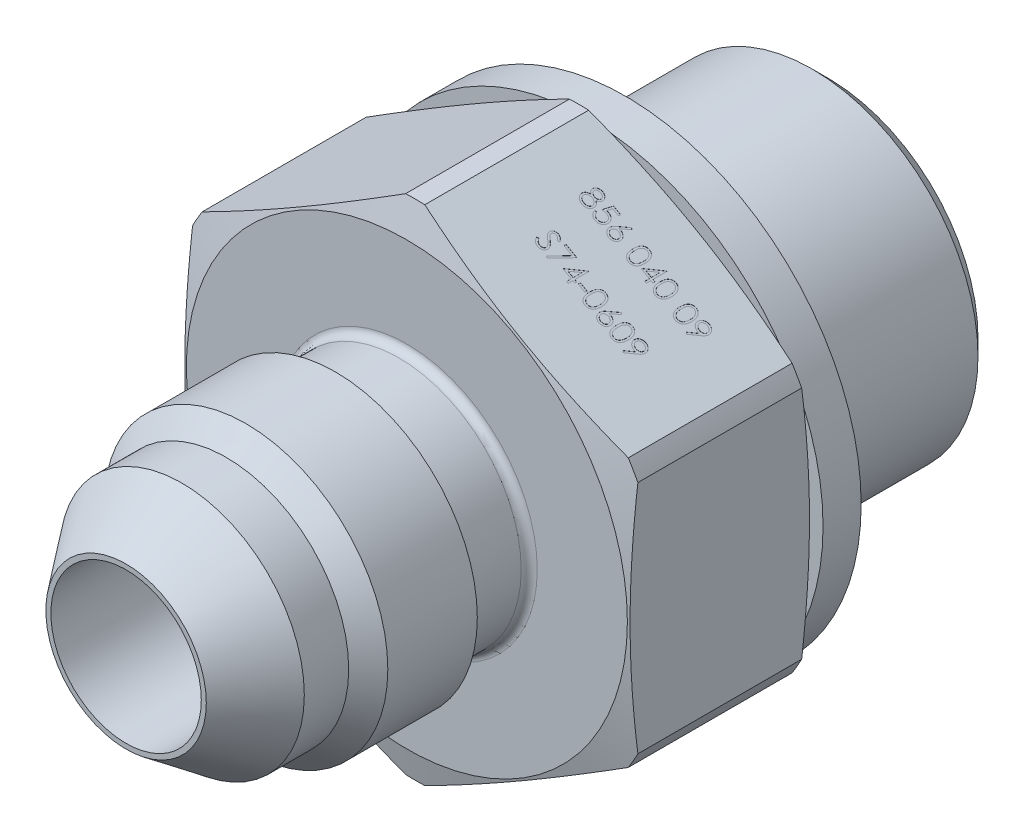
from build123d import *

# Parameters (mm, degrees)
SKETCH2_OUTSIDE_W  = 37.07
SKETCH2_OUTSIDE_H  = 37.07
EXTRUDE2_DEPTH     = 9
SKETCH3_R          = 11.75
SKETCH3_R_2        = 9.6
EXTRUDE3_DEPTH     = 1.9
SKETCH5_W          = 0.384615385
SKETCH5_H          = 0.102564102
CUT_EXTRUDE1_DEPTH = 0.01
SKETCH6_R          = 1.2


with BuildPart() as part:
    # Sketch1 → Revolve1 (revolve)
    with BuildSketch(Plane(origin=(0, 0, 0), x_dir=(0, 0, -1), z_dir=(1, 0, 0)), mode=Mode.PRIVATE) as revolve1_sk:
        with BuildLine():
            Line((0, 4), (2.786794125, 6.1))
            Line((2.786794125, 6.1), (5, 6.1))
            Line((5, 6.1), (5.975, 7.075))
            Line((5.975, 7.075), (10.437083488, 7.075))
            Line((10.437083488, 7.075), (11, 6.1))
            Line((11, 6.1), (13.6, 6.1))
            ThreePointArc((13.6, 6.1), (13.882842712, 6.217157288), (14, 6.5))
            Line((14, 6.5), (14, 10.99402544))
            Line((14, 10.99402544), (14.416922127, 12.55))
            Line((14.416922127, 12.55), (22.583077873, 12.55))
            Line((22.583077873, 12.55), (23, 10.99402544))
            Line((23, 10.99402544), (23, 7.25))
            Line((23, 7.25), (25.475, 7.25))
            Line((25.475, 7.25), (26.5, 8.275))
            Line((26.5, 8.275), (34.2, 8.275))
            Line((34.2, 8.275), (35, 7.475))
            Line((35, 7.475), (35, 7))
            Line((35, 7), (31.535898385, 5))
            Line((31.535898385, 5), (20.5, 5))
            Line((20.5, 5), (19.748924226, 3.75))
            Line((19.748924226, 3.75), (0, 3.75))
            Line((0, 3.75), (0, 4))
        make_face()
    revolve(revolve1_sk.sketch.rotate(Axis((0, 0, 0), (0, 0, -1)), 90), axis=Axis((0, 0, 0), (0, 0, -1)))

    # Sketch2 outside → Extrude2 (cut)
    with BuildSketch(Plane.XY.offset(-14)):
        Rectangle(SKETCH2_OUTSIDE_W, SKETCH2_OUTSIDE_H)
        Polygon((0, 12.817175976), (-11.1, 6.408587988), (-11.1, -6.408587988), (0, -12.817175976), (11.1, -6.408587988), (11.1, 6.408587988), align=None, mode=Mode.SUBTRACT)
    extrude(amount=-EXTRUDE2_DEPTH, mode=Mode.SUBTRACT)

    # Sketch5 → Cut-Extrude1 (cut)
    # profile 1 of 16: a face of its own
    with BuildSketch(Plane(origin=(5.55, 9.612881982, 0), x_dir=(0.8660254037844386, -0.5000000000000001, 0), z_dir=(0.5000000000000001, 0.8660254037844386, 0))):
        with BuildLine():
            add(Edge.make_bspline(
                [(-2.871822735, 20.366585469), (-2.863637436, 20.362317482), (-2.847673369, 20.353993481), (-2.824937024, 20.340590387), (-2.804158452, 20.326464397), (-2.784761149, 20.312282723), (-2.767085906, 20.297502251), (-2.751330359, 20.282064207), (-2.737105325, 20.266353937), (-2.724697672, 20.250105411), (-2.71378429, 20.233361797), (-2.704352252, 20.216079147), (-2.696290194, 20.198295338), (-2.689900783, 20.179816243), (-2.684637414, 20.160913311), (-2.681015812, 20.14134246), (-2.679068121, 20.121232648), (-2.678699889, 20.107641705), (-2.67851344, 20.100760149)],
                knots=[0, 0, 0, 0, 1.272397273, 2.481599622, 3.635517121, 4.734568067, 5.792894095, 6.808321871, 7.773003508, 8.711915296, 9.623354172, 10.525449501, 11.423591555, 12.311487226, 13.218079475, 14.126165749, 15.051214107, 16, 16, 16, 16], degree=3))
            add(Edge.make_bspline(
                [(-2.67851344, 20.100760149), (-2.678733846, 20.091132225), (-2.679170112, 20.072074952), (-2.682970108, 20.043947491), (-2.68865953, 20.016629839), (-2.696967962, 19.990127985), (-2.707743217, 19.964588164), (-2.721022313, 19.939988514), (-2.736054085, 19.915925854), (-2.748126154, 19.901120311), (-2.754234594, 19.893628738)],
                knots=[0, 0, 0, 0, 1.025265484, 2.029385089, 3.018602448, 3.995076438, 4.983346944, 5.966715145, 6.97116228, 8, 8, 8, 8], degree=3))
            add(Edge.make_bspline(
                [(-2.754234594, 19.893628738), (-2.762187873, 19.88488766), (-2.777996148, 19.867513519), (-2.805076985, 19.844956145), (-2.834797523, 19.825999175), (-2.867042761, 19.810550062), (-2.901726504, 19.798525531), (-2.938841363, 19.789884812), (-2.978459692, 19.784935546), (-3.005689827, 19.784220121), (-3.019659274, 19.783853097)],
                knots=[0, 0, 0, 0, 0.954267603, 1.896743057, 2.838368354, 3.796610408, 4.779680527, 5.799409237, 6.871065594, 8, 8, 8, 8], degree=3))
            add(Edge.make_bspline(
                [(-3.019659274, 19.783853097), (-3.03309167, 19.784182377), (-3.05922975, 19.784823121), (-3.097274858, 19.789164387), (-3.132738592, 19.796772349), (-3.165827155, 19.807185095), (-3.196341067, 19.820730874), (-3.224193382, 19.837590419), (-3.249785945, 19.857085117), (-3.27234208, 19.879774854), (-3.29236735, 19.904077103), (-3.309958222, 19.929148992), (-3.324579388, 19.954992808), (-3.336958558, 19.981223199), (-3.346435136, 20.008207814), (-3.352998624, 20.035807818), (-3.357167, 20.063975001), (-3.35772161, 20.082984045), (-3.35800062, 20.092547007)],
                knots=[0, 0, 0, 0, 1.256902934, 2.445805442, 3.576955095, 4.645999104, 5.686449165, 6.692658513, 7.68621702, 8.689161843, 9.678783111, 10.630372946, 11.551080876, 12.453998257, 13.34127905, 14.221779781, 15.105423033, 16, 16, 16, 16], degree=3))
            add(Edge.make_bspline(
                [(-3.35800062, 20.092547007), (-3.357835511, 20.09956392), (-3.357509198, 20.113431814), (-3.355250669, 20.133920194), (-3.351619681, 20.153861947), (-3.346688407, 20.173330731), (-3.340005257, 20.192184808), (-3.331936076, 20.210513515), (-3.322526947, 20.228337543), (-3.311646614, 20.245754367), (-3.298988893, 20.262519942), (-3.284656421, 20.278918797), (-3.268362744, 20.294696473), (-3.250289128, 20.310045738), (-3.230642116, 20.325238873), (-3.208911393, 20.339454796), (-3.185673031, 20.353699928), (-3.169157201, 20.362216593), (-3.160684915, 20.366585469)],
                knots=[0, 0, 0, 0, 0.941657376, 1.861047343, 2.762797495, 3.66048619, 4.553285746, 5.444104102, 6.34607688, 7.256116206, 8.197091036, 9.162375105, 10.176350973, 11.237807142, 12.343728897, 13.50695164, 14.721116704, 16, 16, 16, 16], degree=3))
            add(Edge.make_bspline(
                [(-3.160684915, 20.366585469), (-3.17228245, 20.372909689), (-3.194738525, 20.385155148), (-3.224472651, 20.407654235), (-3.25001283, 20.432022182), (-3.270657035, 20.458773552), (-3.286906243, 20.487072659), (-3.298054415, 20.516742446), (-3.305596268, 20.547232764), (-3.306343361, 20.568063106), (-3.306718569, 20.578524572)],
                knots=[0, 0, 0, 0, 1.166880483, 2.259407225, 3.286803203, 4.280235371, 5.237608625, 6.161067461, 7.076446754, 8, 8, 8, 8], degree=3))
            add(Edge.make_bspline(
                [(-3.306718569, 20.578524572), (-3.306251304, 20.589181017), (-3.305312022, 20.61060233), (-3.297716788, 20.642489794), (-3.285339626, 20.673808813), (-3.268505055, 20.704407588), (-3.247537279, 20.733250506), (-3.222381123, 20.759119348), (-3.193637324, 20.781779772), (-3.161449362, 20.800801535), (-3.126810438, 20.816282581), (-3.090263088, 20.82696213), (-3.05244409, 20.833943878), (-3.026701885, 20.83473435), (-3.013649658, 20.835135149)],
                knots=[0, 0, 0, 0, 0.888701115, 1.786444228, 2.72001202, 3.692817113, 4.693886446, 5.687152267, 6.695133018, 7.739871481, 8.800368666, 9.853104506, 10.91144658, 12, 12, 12, 12], degree=3))
            add(Edge.make_bspline(
                [(-3.013649658, 20.835135149), (-3.000934283, 20.834721908), (-2.97586101, 20.833907044), (-2.939005402, 20.827110793), (-2.903741152, 20.815759501), (-2.870189866, 20.800360295), (-2.83895219, 20.781392597), (-2.81135153, 20.758420919), (-2.786970792, 20.73266619), (-2.766803823, 20.703832018), (-2.750185854, 20.67335082), (-2.738614168, 20.641458671), (-2.731199318, 20.608844654), (-2.730264071, 20.586776653), (-2.729795492, 20.575720084)],
                knots=[0, 0, 0, 0, 1.072916533, 2.115669174, 3.151510826, 4.193348718, 5.225979165, 6.227137561, 7.216255879, 8.211077061, 9.189680878, 10.138522389, 11.067357538, 12, 12, 12, 12], degree=3))
            add(Edge.make_bspline(
                [(-2.729795492, 20.575720084), (-2.730205366, 20.564869609), (-2.731010336, 20.543559892), (-2.737781748, 20.512495172), (-2.749185551, 20.483403161), (-2.764755312, 20.455953746), (-2.785048309, 20.430644747), (-2.809793661, 20.407154327), (-2.838794083, 20.385289519), (-2.860582908, 20.372950557), (-2.871822735, 20.366585469)],
                knots=[0, 0, 0, 0, 0.975232327, 1.915300861, 2.843280834, 3.77672583, 4.742871857, 5.749627742, 6.839139064, 8, 8, 8, 8], degree=3))
        make_face()
        with BuildLine():
            add(Edge.make_bspline(
                [(-3.018657671, 20.732571046), (-3.025672187, 20.73238492), (-3.039395647, 20.732020776), (-3.059518125, 20.730118309), (-3.078653087, 20.72641739), (-3.097000459, 20.721492044), (-3.114308691, 20.714838333), (-3.130812849, 20.707011187), (-3.146232046, 20.697495168), (-3.160752418, 20.68682054), (-3.173824068, 20.67507971), (-3.185425369, 20.662847219), (-3.195061973, 20.649882821), (-3.203245147, 20.636509004), (-3.209182723, 20.62232884), (-3.213629667, 20.607777075), (-3.216635779, 20.592669822), (-3.216861033, 20.582345105), (-3.216974979, 20.577122328)],
                knots=[0, 0, 0, 0, 1.203892937, 2.355340988, 3.463153438, 4.544400666, 5.610487187, 6.640501085, 7.674077295, 8.714426146, 9.728707835, 10.68524104, 11.601827946, 12.495867327, 13.368432065, 14.231010473, 15.105153427, 16, 16, 16, 16], degree=3))
            add(Edge.make_bspline(
                [(-3.216974979, 20.577122328), (-3.216778588, 20.571899325), (-3.216390492, 20.561577922), (-3.213389027, 20.546336246), (-3.20891564, 20.531358635), (-3.201872594, 20.517001232), (-3.193425063, 20.502765986), (-3.182998927, 20.489008676), (-3.17057349, 20.475681423), (-3.15656565, 20.462897583), (-3.141305211, 20.450926508), (-3.125138341, 20.44053417), (-3.108267944, 20.43183871), (-3.090867353, 20.424601737), (-3.072759225, 20.418976041), (-3.054054518, 20.414984999), (-3.034750089, 20.412504429), (-3.021669923, 20.412208137), (-3.015051902, 20.412058225)],
                knots=[0, 0, 0, 0, 0.873023192, 1.725219244, 2.590779336, 3.480155217, 4.391973325, 5.357036234, 6.360879153, 7.436073238, 8.526419356, 9.601555421, 10.645666583, 11.697338044, 12.750135903, 13.812665442, 14.89329948, 16, 16, 16, 16], degree=3))
            add(Edge.make_bspline(
                [(-3.015051902, 20.412058225), (-3.006551872, 20.412307616), (-2.989635767, 20.412803934), (-2.964698815, 20.417418555), (-2.940452345, 20.424677389), (-2.917155516, 20.434608808), (-2.895411348, 20.447073911), (-2.876028472, 20.46199763), (-2.859172217, 20.479035372), (-2.845017757, 20.497921897), (-2.834043515, 20.51802235), (-2.825500141, 20.538193863), (-2.820511222, 20.558651643), (-2.819860489, 20.57235649), (-2.819539081, 20.579125533)],
                knots=[0, 0, 0, 0, 1.076279235, 2.141928126, 3.20205304, 4.278698113, 5.344010996, 6.36967002, 7.368914609, 8.37248503, 9.349703398, 10.264243087, 11.142681841, 12, 12, 12, 12], degree=3))
            add(Edge.make_bspline(
                [(-2.819539081, 20.579125533), (-2.819691052, 20.583876401), (-2.819992692, 20.593306191), (-2.822478422, 20.607231439), (-2.826585803, 20.620839891), (-2.832146683, 20.634243968), (-2.839463768, 20.647255606), (-2.84813925, 20.660079346), (-2.858677679, 20.672426707), (-2.870505231, 20.684585435), (-2.883918205, 20.695838013), (-2.898890751, 20.705733644), (-2.915346109, 20.714137175), (-2.933284666, 20.720962533), (-2.952640358, 20.726088919), (-2.973324037, 20.729927876), (-2.995508164, 20.732091622), (-3.010773808, 20.732407772), (-3.018657671, 20.732571046)],
                knots=[0, 0, 0, 0, 0.814439003, 1.616544685, 2.417341072, 3.248991801, 4.09997495, 4.973547432, 5.9003056, 6.880240646, 7.880314356, 8.896779544, 9.951930927, 11.043077905, 12.18215768, 13.381699519, 14.647792085, 16, 16, 16, 16], degree=3))
        make_face(mode=Mode.SUBTRACT)
        with BuildLine():
            add(Edge.make_bspline(
                [(-3.012848376, 20.309494123), (-3.021741458, 20.30933594), (-3.039187514, 20.309025623), (-3.064746636, 20.30557148), (-3.089276112, 20.300763082), (-3.112693237, 20.293468556), (-3.134988122, 20.283983845), (-3.156281459, 20.272573976), (-3.176410354, 20.259086707), (-3.195096847, 20.243693388), (-3.212160655, 20.227104973), (-3.227131598, 20.209544363), (-3.239845175, 20.191337925), (-3.250083247, 20.172254431), (-3.258486599, 20.15269797), (-3.26400485, 20.132181515), (-3.267542482, 20.111099482), (-3.268017519, 20.096768026), (-3.26825703, 20.0895422)],
                knots=[0, 0, 0, 0, 1.140299081, 2.23698856, 3.303958914, 4.344563908, 5.37730929, 6.408454204, 7.439741482, 8.480804886, 9.510774543, 10.48932336, 11.43758569, 12.353841022, 13.263987381, 14.161954604, 15.073269652, 16, 16, 16, 16], degree=3))
            add(Edge.make_bspline(
                [(-3.26825703, 20.0895422), (-3.267867528, 20.080561941), (-3.267094764, 20.062745317), (-3.260964295, 20.036413011), (-3.251125571, 20.010921281), (-3.237404081, 19.986477866), (-3.220413346, 19.963634978), (-3.199520069, 19.9437239), (-3.176022687, 19.926032049), (-3.149126157, 19.911723325), (-3.119746595, 19.900296223), (-3.087891816, 19.892423091), (-3.054018982, 19.887211248), (-3.030630527, 19.886686054), (-3.018657671, 19.8864172)],
                knots=[0, 0, 0, 0, 0.898778495, 1.783155532, 2.693654817, 3.627872908, 4.583023416, 5.533784346, 6.509005473, 7.520592997, 8.575161974, 9.658835044, 10.801527049, 12, 12, 12, 12], degree=3))
            add(Edge.make_bspline(
                [(-3.018657671, 19.8864172), (-3.009300423, 19.886596859), (-2.991069503, 19.886946894), (-2.964473518, 19.890036692), (-2.939375076, 19.894936585), (-2.915822847, 19.902063312), (-2.893553179, 19.910763306), (-2.872943649, 19.921955329), (-2.85346407, 19.934684564), (-2.836074321, 19.949786894), (-2.820236261, 19.965923893), (-2.806426749, 19.983006762), (-2.794438877, 20.000571229), (-2.785030033, 20.019014224), (-2.777508246, 20.037981914), (-2.772101516, 20.057649203), (-2.768765454, 20.078076413), (-2.768428056, 20.09193329), (-2.76825703, 20.098957264)],
                knots=[0, 0, 0, 0, 1.224942928, 2.386581632, 3.501229538, 4.569074225, 5.605009692, 6.626002462, 7.634866581, 8.645888296, 9.63523824, 10.59253846, 11.518950513, 12.414518923, 13.29783783, 14.186679152, 15.080837789, 16, 16, 16, 16], degree=3))
            add(Edge.make_bspline(
                [(-2.76825703, 20.098957264), (-2.768515844, 20.105779361), (-2.76902618, 20.119231345), (-2.772265234, 20.139164639), (-2.777955485, 20.158422586), (-2.785763313, 20.177236873), (-2.796157873, 20.195226288), (-2.808399265, 20.212859479), (-2.823169013, 20.229647035), (-2.839858326, 20.245719348), (-2.858046601, 20.260580987), (-2.877380071, 20.27372797), (-2.897709917, 20.284800003), (-2.91899312, 20.293804716), (-2.941182422, 20.30088685), (-2.964261501, 20.305834277), (-2.98825738, 20.308948449), (-3.004558771, 20.309310177), (-3.012848376, 20.309494123)],
                knots=[0, 0, 0, 0, 0.917430815, 1.809013306, 2.70690318, 3.612392954, 4.541220862, 5.495268465, 6.494511384, 7.542276156, 8.608045339, 9.649016899, 10.681629292, 11.715607085, 12.752076957, 13.808767841, 14.885711793, 16, 16, 16, 16], degree=3))
        make_face(mode=Mode.SUBTRACT)
    # profile 2 of 16: a face of its own
    with BuildSketch(Plane(origin=(5.55, 9.612881982, 0), x_dir=(0.8660254037844386, -0.5000000000000001, 0), z_dir=(0.5000000000000001, 0.8660254037844386, 0))):
        with BuildLine():
            Line((-1.960564722, 20.809494123), (-1.960564722, 20.70693002))
            Line((-1.960564722, 20.70693002), (-2.300508633, 20.70693002))
            Line((-2.300508633, 20.70693002), (-2.354595171, 20.443909187))
            add(Edge.make_bspline(
                [(-2.354595171, 20.443909187), (-2.344007778, 20.446832122), (-2.32349638, 20.452494846), (-2.293222134, 20.458782209), (-2.264481504, 20.462572336), (-2.245831398, 20.463089853), (-2.23680671, 20.463340277)],
                knots=[0, 0, 0, 0, 1.100273476, 2.13160584, 3.095893838, 4, 4, 4, 4], degree=3))
            add(Edge.make_bspline(
                [(-2.23680671, 20.463340277), (-2.225639927, 20.463098581), (-2.203683242, 20.462623346), (-2.171557828, 20.458059961), (-2.140891287, 20.450877128), (-2.111747753, 20.440842693), (-2.08407331, 20.428011341), (-2.058122578, 20.411982786), (-2.033506032, 20.393258978), (-2.010665291, 20.371731831), (-1.98994406, 20.348039941), (-1.971725205, 20.322566263), (-1.95625018, 20.29555836), (-1.94380425, 20.266758186), (-1.933865868, 20.236484142), (-1.927251013, 20.20441769), (-1.922846239, 20.170861084), (-1.922354128, 20.147916921), (-1.922103184, 20.136216879)],
                knots=[0, 0, 0, 0, 1.052922333, 2.070308379, 3.05430497, 4.020497103, 4.973039431, 5.925935799, 6.892292201, 7.88610001, 8.88166317, 9.857072816, 10.836096531, 11.812156883, 12.81219415, 13.836441305, 14.89672472, 16, 16, 16, 16], degree=3))
            add(Edge.make_bspline(
                [(-1.922103184, 20.136216879), (-1.922293205, 20.128067673), (-1.92267068, 20.111879391), (-1.924590277, 20.087838191), (-1.928286196, 20.064305953), (-1.933248403, 20.041279555), (-1.939689094, 20.018802592), (-1.947485966, 19.996810727), (-1.957027688, 19.975440839), (-1.967493795, 19.954490726), (-1.979278503, 19.93443401), (-1.992358077, 19.915677157), (-2.006176789, 19.897938791), (-2.021045756, 19.881409153), (-2.037103183, 19.866196862), (-2.054154602, 19.852211638), (-2.072063951, 19.839216973), (-2.091108306, 19.827740345), (-2.110863301, 19.817179501), (-2.13161422, 19.808515633), (-2.152888706, 19.800769768), (-2.174992956, 19.794595617), (-2.197876902, 19.789757744), (-2.221578267, 19.786471858), (-2.245972744, 19.784078591), (-2.262508462, 19.783928774), (-2.270861197, 19.783853097)],
                knots=[0, 0, 0, 0, 1.056347294, 2.098418968, 3.122841568, 4.141288669, 5.149314143, 6.15115421, 7.162517403, 8.180376062, 9.185164535, 10.17417709, 11.141909838, 12.097768115, 13.052685741, 14.0056014, 14.954263652, 15.917497458, 16.885230207, 17.854509472, 18.828990115, 19.81800267, 20.826176721, 21.857883937, 22.917946725, 24, 24, 24, 24], degree=3))
            add(Edge.make_bspline(
                [(-2.270861197, 19.783853097), (-2.280825248, 19.78405048), (-2.300428343, 19.784438806), (-2.329148505, 19.78850123), (-2.356781249, 19.794319492), (-2.383104135, 19.803072712), (-2.408353068, 19.81404051), (-2.43218813, 19.827902274), (-2.455218352, 19.843610589), (-2.476507505, 19.862147833), (-2.496266395, 19.882409456), (-2.513953969, 19.904397354), (-2.529706419, 19.927748623), (-2.54327149, 19.952576667), (-2.554842353, 19.978816247), (-2.56393235, 20.006565676), (-2.571269023, 20.035679963), (-2.574372857, 20.055723823), (-2.575949338, 20.065904379)],
                knots=[0, 0, 0, 0, 1.0467383, 2.05933395, 3.04377827, 4.011590433, 4.970194871, 5.932262533, 6.905835911, 7.896367577, 8.894135286, 9.877477877, 10.858688626, 11.851381753, 12.8477658, 13.868841284, 14.917554742, 16, 16, 16, 16], degree=3))
            Line((-2.575949338, 20.065904379), (-2.486205748, 20.065904379))
            add(Edge.make_bspline(
                [(-2.486205748, 20.065904379), (-2.483997589, 20.05636825), (-2.479753384, 20.03803928), (-2.470437456, 20.012287468), (-2.459047206, 19.989339119), (-2.445503106, 19.968890666), (-2.429345955, 19.951059524), (-2.410908975, 19.935168935), (-2.390238197, 19.920833184), (-2.367268703, 19.908883822), (-2.343036394, 19.898692749), (-2.317674334, 19.891906551), (-2.291873092, 19.887134867), (-2.27442213, 19.886657221), (-2.265652863, 19.8864172)],
                knots=[0, 0, 0, 0, 1.136247022, 2.183929868, 3.172523383, 4.106158343, 5.02341133, 5.958108904, 6.928429099, 7.938127109, 8.96079061, 9.975095812, 10.982467395, 12, 12, 12, 12], degree=3))
            add(Edge.make_bspline(
                [(-2.265652863, 19.8864172), (-2.257093308, 19.886651708), (-2.240239473, 19.887113456), (-2.21543622, 19.890667459), (-2.191489684, 19.896141051), (-2.168636154, 19.904332438), (-2.146475714, 19.914288072), (-2.125568922, 19.927063808), (-2.105310957, 19.94176667), (-2.086331491, 19.958611422), (-2.068948791, 19.977174192), (-2.053589899, 19.997024876), (-2.040796495, 20.018201118), (-2.030015321, 20.040336304), (-2.021828664, 20.063673035), (-2.015988384, 20.088101942), (-2.012558939, 20.113683365), (-2.012087173, 20.131131739), (-2.011846774, 20.140022969)],
                knots=[0, 0, 0, 0, 1.027316725, 2.022795036, 3.002884548, 3.971462791, 4.93288096, 5.914575861, 6.907176829, 7.935150275, 8.956128384, 9.956726525, 10.942570165, 11.921478529, 12.907843606, 13.90538589, 14.932640048, 16, 16, 16, 16], degree=3))
            add(Edge.make_bspline(
                [(-2.011846774, 20.140022969), (-2.012034911, 20.148044612), (-2.012403162, 20.163745838), (-2.015411896, 20.18671704), (-2.020645317, 20.208452195), (-2.027909283, 20.229056261), (-2.037131999, 20.248548674), (-2.048402374, 20.266949548), (-2.061931916, 20.284016357), (-2.077386742, 20.299757087), (-2.094317611, 20.314284194), (-2.113015823, 20.326668219), (-2.133090088, 20.337086481), (-2.154298545, 20.346077338), (-2.177145658, 20.352534693), (-2.201178982, 20.357382661), (-2.226658041, 20.36018705), (-2.244078238, 20.360576161), (-2.253032671, 20.360776174)],
                knots=[0, 0, 0, 0, 1.045622112, 2.046656509, 3.013763289, 3.955457236, 4.890082067, 5.820317437, 6.762574623, 7.722996705, 8.69280354, 9.665887285, 10.63943826, 11.638615906, 12.663482002, 13.728887084, 14.832589034, 16, 16, 16, 16], degree=3))
            add(Edge.make_bspline(
                [(-2.253032671, 20.360776174), (-2.260783794, 20.360610291), (-2.276787895, 20.360267784), (-2.301337274, 20.357745928), (-2.327134909, 20.353677558), (-2.354081908, 20.348081487), (-2.382259196, 20.340758323), (-2.411607311, 20.331982751), (-2.442187958, 20.321490751), (-2.462793022, 20.313567262), (-2.473385235, 20.309494123)],
                knots=[0, 0, 0, 0, 0.817624296, 1.688186739, 2.600797293, 3.572016777, 4.590301741, 5.671205678, 6.80286297, 8, 8, 8, 8], degree=3))
            Line((-2.473385235, 20.309494123), (-2.370821133, 20.809494123))
            Line((-2.370821133, 20.809494123), (-1.960564722, 20.809494123))
        make_face()
    # profile 3 of 16: a face of its own
    with BuildSketch(Plane(origin=(5.55, 9.612881982, 0), x_dir=(0.8660254037844386, -0.5000000000000001, 0), z_dir=(0.5000000000000001, 0.8660254037844386, 0))):
        with BuildLine():
            Line((-1.35800062, 20.835135149), (-1.288689722, 20.78084829))
            Line((-1.288689722, 20.78084829), (-1.552912479, 20.376801815))
            add(Edge.make_bspline(
                [(-1.552912479, 20.376801815), (-1.535320971, 20.379605775), (-1.501006746, 20.385075217), (-1.466273632, 20.385977487), (-1.449346774, 20.3864172)],
                knots=[0, 0, 0, 0, 1.025318673, 2, 2, 2, 2], degree=3))
            add(Edge.make_bspline(
                [(-1.449346774, 20.3864172), (-1.439182692, 20.386147981), (-1.419241175, 20.385619786), (-1.389939908, 20.38144562), (-1.361777796, 20.374948555), (-1.334817664, 20.365439704), (-1.309025296, 20.353296838), (-1.284253206, 20.338742695), (-1.260966911, 20.321026836), (-1.238866576, 20.301236834), (-1.218801691, 20.2793177), (-1.201037103, 20.256060174), (-1.186115163, 20.231488494), (-1.174008328, 20.205615104), (-1.164606934, 20.178479887), (-1.157753321, 20.150117561), (-1.153702009, 20.120508569), (-1.153151869, 20.100371948), (-1.152872415, 20.090143161)],
                knots=[0, 0, 0, 0, 1.044136307, 2.048553127, 3.035567123, 4.010001674, 4.980053131, 5.96154148, 6.956538004, 7.981742224, 9.006487041, 10.005615874, 10.984750588, 11.954802044, 12.935714515, 13.930994945, 14.949008866, 16, 16, 16, 16], degree=3))
            add(Edge.make_bspline(
                [(-1.152872415, 20.090143161), (-1.153279016, 20.07614896), (-1.154079111, 20.048611684), (-1.162051625, 20.008504054), (-1.174440094, 19.970294764), (-1.19214796, 19.934593858), (-1.214142926, 19.901450266), (-1.240965096, 19.87208299), (-1.271663235, 19.845891551), (-1.306373749, 19.82398966), (-1.343728882, 19.806103074), (-1.382972309, 19.793255862), (-1.423722923, 19.785346299), (-1.451381382, 19.784354699), (-1.465372415, 19.783853097)],
                knots=[0, 0, 0, 0, 1.031375318, 2.029502543, 3.004789286, 3.987476834, 4.960371455, 5.9300674, 6.912260825, 7.929083631, 8.949397511, 9.960523116, 10.96833055, 12, 12, 12, 12], degree=3))
            add(Edge.make_bspline(
                [(-1.465372415, 19.783853097), (-1.478828615, 19.784289727), (-1.505482991, 19.785154615), (-1.544692361, 19.792859169), (-1.582367509, 19.805346913), (-1.618244475, 19.822550992), (-1.651478936, 19.844281816), (-1.681211975, 19.870442467), (-1.707295339, 19.900473743), (-1.729002374, 19.934370985), (-1.746219154, 19.970796687), (-1.759130561, 20.008778732), (-1.766672345, 20.048178727), (-1.767726218, 20.074887624), (-1.76825703, 20.088340277)],
                knots=[0, 0, 0, 0, 1.012016664, 2.004627821, 2.994792927, 3.992885782, 4.990978636, 5.973936114, 6.964471063, 7.975201453, 8.993600317, 9.990122807, 10.98767138, 12, 12, 12, 12], degree=3))
            add(Edge.make_bspline(
                [(-1.76825703, 20.088340277), (-1.767919474, 20.098638729), (-1.76723025, 20.119666201), (-1.762417853, 20.151513066), (-1.754685054, 20.18409909), (-1.746024984, 20.211743145), (-1.73687481, 20.234389294), (-1.729259798, 20.252647434), (-1.719781514, 20.271436312), (-1.709674833, 20.291400208), (-1.698030014, 20.312024618), (-1.6853684, 20.333654237), (-1.671339928, 20.355945074), (-1.661505596, 20.371071987), (-1.656478184, 20.37880502)],
                knots=[0, 0, 0, 0, 1.173818275, 2.396712641, 3.66331629, 4.989737886, 5.693666774, 6.447286557, 7.243889047, 8.091586357, 8.998013824, 9.943181721, 10.948533338, 12, 12, 12, 12], degree=3))
            Line((-1.656478184, 20.37880502), (-1.35800062, 20.835135149))
        make_face()
        with BuildLine():
            add(Edge.make_bspline(
                [(-1.468176902, 20.283853097), (-1.475794442, 20.283627849), (-1.490739994, 20.283185914), (-1.512639697, 20.280689992), (-1.533310086, 20.275960506), (-1.552988619, 20.269844071), (-1.571465251, 20.261511461), (-1.588969035, 20.251526626), (-1.605298512, 20.239563919), (-1.620373969, 20.226059372), (-1.634035176, 20.211260144), (-1.645801618, 20.195412398), (-1.65595077, 20.178893876), (-1.664202746, 20.161567654), (-1.670628475, 20.14344007), (-1.675276549, 20.124594573), (-1.677863334, 20.104904771), (-1.678293686, 20.091552627), (-1.67851344, 20.084734507)],
                knots=[0, 0, 0, 0, 1.128956033, 2.215002439, 3.259141796, 4.2666399, 5.263148119, 6.255916712, 7.247353359, 8.256307737, 9.250603402, 10.226115518, 11.176314381, 12.118911324, 13.063945463, 14.021379252, 14.989639887, 16, 16, 16, 16], degree=3))
            add(Edge.make_bspline(
                [(-1.67851344, 20.084734507), (-1.67833448, 20.07797737), (-1.677983565, 20.06472763), (-1.674797188, 20.045202151), (-1.669930022, 20.026412177), (-1.662689909, 20.008454577), (-1.654053655, 19.991055629), (-1.642652134, 19.974845548), (-1.630018766, 19.958839813), (-1.614917642, 19.944267964), (-1.598710967, 19.930708929), (-1.581396338, 19.918857428), (-1.563350635, 19.908718521), (-1.544330229, 19.900772493), (-1.524604976, 19.894251268), (-1.504010532, 19.889662274), (-1.482532574, 19.887067838), (-1.467983448, 19.886636926), (-1.460564722, 19.8864172)],
                knots=[0, 0, 0, 0, 0.989467248, 1.94019797, 2.891935182, 3.827694429, 4.772920941, 5.730924762, 6.725747692, 7.756678648, 8.79901574, 9.819492441, 10.826891316, 11.826466727, 12.835195252, 13.867842842, 14.912794438, 16, 16, 16, 16], degree=3))
            add(Edge.make_bspline(
                [(-1.460564722, 19.8864172), (-1.453146009, 19.886636943), (-1.438596907, 19.887067889), (-1.417118776, 19.88966208), (-1.39652497, 19.89425198), (-1.376797396, 19.900769914), (-1.357785559, 19.908728088), (-1.339755639, 19.918794351), (-1.322604755, 19.930781813), (-1.306387441, 19.944244793), (-1.291349172, 19.958922751), (-1.278412807, 19.974702671), (-1.267360455, 19.991186641), (-1.258379258, 20.008386038), (-1.251218889, 20.026423035), (-1.246327042, 20.045199242), (-1.243147245, 20.064728392), (-1.242795426, 20.077977628), (-1.242616004, 20.084734507)],
                knots=[0, 0, 0, 0, 1.087397944, 2.132534446, 3.165364764, 4.174271784, 5.174024072, 6.181601208, 7.194203697, 8.236725232, 9.267838612, 10.269026844, 11.221737037, 12.171628256, 13.107553087, 14.05945871, 15.010357665, 16, 16, 16, 16], degree=3))
            add(Edge.make_bspline(
                [(-1.242616004, 20.084734507), (-1.242773231, 20.091561522), (-1.243081816, 20.10496073), (-1.246572084, 20.124585769), (-1.251412773, 20.143535811), (-1.258722171, 20.161691858), (-1.268218477, 20.178981888), (-1.279784586, 20.19549468), (-1.29316759, 20.211351227), (-1.308615184, 20.226097304), (-1.325431071, 20.239480657), (-1.343197108, 20.251571536), (-1.362023863, 20.261418518), (-1.381571651, 20.269872413), (-1.40207592, 20.275863553), (-1.423312706, 20.280704758), (-1.445483241, 20.283165049), (-1.46056004, 20.283622162), (-1.468176902, 20.283853097)],
                knots=[0, 0, 0, 0, 0.978753431, 1.920974676, 2.853199117, 3.782215702, 4.721507756, 5.67862441, 6.671401678, 7.694929396, 8.738190014, 9.75360867, 10.774035531, 11.783329636, 12.805060902, 13.835252836, 14.906360638, 16, 16, 16, 16], degree=3))
        make_face(mode=Mode.SUBTRACT)
    # profile 4 of 16: a face of its own
    with BuildSketch(Plane(origin=(5.55, 9.612881982, 0), x_dir=(0.8660254037844386, -0.5000000000000001, 0), z_dir=(0.5000000000000001, 0.8660254037844386, 0))):
        with BuildLine():
            add(Edge.make_bspline(
                [(-0.665692927, 20.309093482), (-0.665599208, 20.325121307), (-0.665417157, 20.356255588), (-0.663391893, 20.401622629), (-0.66002751, 20.444182711), (-0.655416832, 20.483937873), (-0.64980598, 20.520898377), (-0.642315841, 20.554965451), (-0.633797898, 20.586296767), (-0.62392577, 20.614994495), (-0.612786402, 20.641445267), (-0.600662328, 20.666138182), (-0.587072386, 20.689035877), (-0.572793268, 20.710503817), (-0.557246962, 20.730190587), (-0.540875879, 20.748374205), (-0.523041058, 20.764634419), (-0.504348769, 20.779447648), (-0.48462978, 20.792433212), (-0.464446161, 20.803871137), (-0.443658988, 20.813642528), (-0.422211507, 20.821325509), (-0.40029649, 20.827671466), (-0.377837328, 20.832011165), (-0.354796939, 20.83474171), (-0.3392451, 20.835002758), (-0.331357992, 20.835135149)],
                knots=[0, 0, 0, 0, 1.646270934, 3.197905019, 4.663502075, 6.030701355, 7.308322542, 8.50163776, 9.611534131, 10.641858119, 11.616356847, 12.558055219, 13.465016945, 14.349605745, 15.204443733, 16.039544428, 16.859896111, 17.680448484, 18.487036065, 19.28249412, 20.06191084, 20.843045899, 21.620316918, 22.403196591, 23.190181807, 24, 24, 24, 24], degree=3))
            add(Edge.make_bspline(
                [(-0.331357992, 20.835135149), (-0.323404998, 20.834995773), (-0.307588995, 20.834718598), (-0.284206031, 20.832054615), (-0.261363265, 20.827634294), (-0.239158082, 20.821371158), (-0.217408086, 20.813600965), (-0.196283398, 20.803861788), (-0.175652803, 20.792524969), (-0.15584415, 20.779203861), (-0.136639974, 20.764351783), (-0.118511985, 20.747562449), (-0.101458531, 20.729005386), (-0.085265587, 20.708879139), (-0.070392559, 20.686797686), (-0.056228721, 20.663145084), (-0.043550997, 20.637507694), (-0.03134109, 20.610313274), (-0.020801951, 20.580809372), (-0.011297309, 20.549162297), (-0.003617604, 20.514998244), (0.002779331, 20.478496459), (0.007735016, 20.439522893), (0.011344342, 20.398161088), (0.013250938, 20.354383834), (0.013609995, 20.32445302), (0.013794252, 20.309093482)],
                knots=[0, 0, 0, 0, 0.810914788, 1.612654377, 2.396697861, 3.181598691, 3.963628158, 4.749916497, 5.551656086, 6.361998678, 7.18212741, 8.025565596, 8.878627764, 9.750805457, 10.657531673, 11.591944965, 12.560506719, 13.57287815, 14.630710178, 15.753379473, 16.941251878, 18.199788006, 19.531962791, 20.947069417, 22.433333509, 24, 24, 24, 24], degree=3))
            add(Edge.make_bspline(
                [(0.013794252, 20.309093482), (0.013608085, 20.293800937), (0.013245346, 20.264004036), (0.011365716, 20.220423758), (0.00766325, 20.179281459), (0.003031824, 20.14047847), (-0.003382736, 20.104176293), (-0.011269927, 20.070249308), (-0.020027162, 20.038551002), (-0.030837103, 20.009341056), (-0.042668735, 19.982211992), (-0.055541648, 19.956878521), (-0.069333027, 19.933116723), (-0.084358382, 19.911116795), (-0.100373643, 19.890722893), (-0.117721583, 19.872295001), (-0.135913179, 19.855389095), (-0.155173869, 19.840345773), (-0.175291455, 19.827178686), (-0.195851191, 19.8154033), (-0.217217872, 19.805908244), (-0.238907287, 19.797755375), (-0.261229678, 19.791526675), (-0.284157218, 19.787219859), (-0.307573285, 19.784199331), (-0.323402304, 19.783968908), (-0.331357992, 19.783853097)],
                knots=[0, 0, 0, 0, 1.561518951, 3.042555995, 4.452378317, 5.7783523, 7.031515105, 8.214008947, 9.334062868, 10.386615937, 11.391082383, 12.354592575, 13.286541444, 14.194233754, 15.072674879, 15.931287219, 16.775624067, 17.606195743, 18.42308326, 19.229000347, 20.022332153, 20.807536673, 21.593273796, 22.3848459, 23.188221202, 24, 24, 24, 24], degree=3))
            add(Edge.make_bspline(
                [(-0.331357992, 19.783853097), (-0.339244881, 19.783986342), (-0.354796288, 19.784249074), (-0.377839839, 19.786967283), (-0.400206251, 19.791337426), (-0.422005895, 19.797456456), (-0.443350614, 19.804946409), (-0.463949553, 19.814704605), (-0.484031748, 19.82594291), (-0.503543621, 19.838741602), (-0.522118524, 19.85340494), (-0.539860983, 19.869623308), (-0.556325274, 19.887801426), (-0.571649301, 19.907652261), (-0.586213327, 19.928993187), (-0.59961029, 19.95211558), (-0.612001963, 19.976927754), (-0.623328675, 20.003590014), (-0.63337115, 20.032491422), (-0.642241924, 20.063962616), (-0.649245969, 20.098281369), (-0.655241099, 20.135172045), (-0.660076637, 20.174793168), (-0.663377873, 20.217166248), (-0.665418248, 20.262264879), (-0.665599697, 20.2931991), (-0.665692927, 20.309093482)],
                knots=[0, 0, 0, 0, 0.810891512, 1.598919785, 2.382837074, 3.152667961, 3.926044502, 4.706494248, 5.493654104, 6.291793342, 7.103789334, 7.925228297, 8.761435821, 9.622817696, 10.50288917, 11.416980706, 12.369136599, 13.353924996, 14.394355917, 15.514179734, 16.714354668, 17.994756427, 19.357759367, 20.818452758, 22.365282078, 24, 24, 24, 24], degree=3))
        make_face()
        with BuildLine():
            add(Edge.make_bspline(
                [(-0.575949338, 20.309494123), (-0.57591521, 20.296137352), (-0.575848975, 20.270214482), (-0.574118632, 20.232544979), (-0.571761423, 20.197410599), (-0.568721052, 20.164766731), (-0.564205924, 20.134723871), (-0.559146842, 20.10707539), (-0.552990245, 20.081967608), (-0.545705954, 20.059228233), (-0.537409069, 20.038471357), (-0.528350251, 20.019156724), (-0.518618616, 20.001056171), (-0.50772743, 19.984332282), (-0.495865983, 19.968930521), (-0.483302195, 19.954578283), (-0.469567171, 19.941779146), (-0.450566101, 19.926428616), (-0.425481394, 19.910566006), (-0.39387555, 19.896752838), (-0.36139885, 19.888072136), (-0.339355636, 19.886968206), (-0.328353184, 19.8864172)],
                knots=[0, 0, 0, 0, 1.459021318, 2.831673884, 4.118529203, 5.306027144, 6.411944654, 7.436330062, 8.375795394, 9.233974572, 10.042671642, 10.816086306, 11.563610507, 12.285937304, 12.993564865, 13.685989202, 14.367179055, 15.041617293, 16.353048772, 17.594441528, 18.799311195, 20, 20, 20, 20], degree=3))
            add(Edge.make_bspline(
                [(-0.328353184, 19.8864172), (-0.317279563, 19.886873709), (-0.295155185, 19.887785784), (-0.262831244, 19.896585423), (-0.231451167, 19.909862434), (-0.206859184, 19.925561721), (-0.188149886, 19.940512673), (-0.174745031, 19.953259715), (-0.162441589, 19.96753282), (-0.150772425, 19.982932619), (-0.140069832, 19.999753329), (-0.130337507, 20.017914064), (-0.12145655, 20.037465258), (-0.116396823, 20.051113755), (-0.113809915, 20.058091879)],
                knots=[0, 0, 0, 0, 1.353760809, 2.704726607, 4.075137775, 5.516104923, 6.260822281, 7.007110065, 7.778089737, 8.566572457, 9.372053459, 10.217411131, 11.088608312, 12, 12, 12, 12], degree=3))
            add(Edge.make_bspline(
                [(-0.113809915, 20.058091879), (-0.110795124, 20.067014662), (-0.104673806, 20.085131737), (-0.096784727, 20.113235638), (-0.090571756, 20.142722142), (-0.084982223, 20.173415033), (-0.081167064, 20.205540661), (-0.07809626, 20.238999628), (-0.076287493, 20.27381716), (-0.076063278, 20.297472872), (-0.075949338, 20.309494123)],
                knots=[0, 0, 0, 0, 0.884706709, 1.796334032, 2.740027952, 3.714592787, 4.726048262, 5.777819803, 6.87074269, 8, 8, 8, 8], degree=3))
            add(Edge.make_bspline(
                [(-0.075949338, 20.309494123), (-0.076106535, 20.321513429), (-0.076414045, 20.345025762), (-0.077589471, 20.379459528), (-0.080624778, 20.412164603), (-0.083995954, 20.44328188), (-0.088966589, 20.47263911), (-0.094325962, 20.500482054), (-0.101526309, 20.526465776), (-0.109217673, 20.550997085), (-0.118020643, 20.573797272), (-0.127710853, 20.594972639), (-0.138059927, 20.614625418), (-0.149300567, 20.632701687), (-0.161299334, 20.649282413), (-0.174372919, 20.664035155), (-0.18800274, 20.677417145), (-0.207093364, 20.692692165), (-0.232086019, 20.708266935), (-0.263184775, 20.72260001), (-0.295547816, 20.73083095), (-0.317425946, 20.731991432), (-0.328353184, 20.732571046)],
                knots=[0, 0, 0, 0, 1.31362396, 2.569729283, 3.763502607, 4.902122613, 5.988968491, 7.01645872, 7.998833611, 8.933434873, 9.825090667, 10.667526885, 11.477055099, 12.250526234, 12.991942729, 13.710640831, 14.402115721, 15.076753259, 16.378508321, 17.609869233, 18.806226677, 20, 20, 20, 20], degree=3))
            add(Edge.make_bspline(
                [(-0.328353184, 20.732571046), (-0.339413353, 20.731990633), (-0.36155384, 20.730828749), (-0.394253256, 20.722630676), (-0.425597356, 20.708341257), (-0.450523921, 20.692640579), (-0.46962786, 20.677686776), (-0.483080058, 20.664719218), (-0.49569325, 20.650534574), (-0.507312593, 20.63499117), (-0.518195245, 20.618286779), (-0.52818982, 20.600289989), (-0.537194771, 20.580909599), (-0.545504639, 20.560162046), (-0.55281115, 20.537424634), (-0.558837996, 20.512347778), (-0.564405726, 20.484787238), (-0.568347231, 20.454581664), (-0.571851162, 20.42192962), (-0.574102975, 20.386707529), (-0.575854763, 20.348974849), (-0.575917181, 20.322917947), (-0.575949338, 20.309494123)],
                knots=[0, 0, 0, 0, 1.207732386, 2.417664972, 3.655092373, 4.956220595, 5.625982001, 6.301752483, 6.994047911, 7.697131622, 8.419323945, 9.170223765, 9.943494443, 10.752040957, 11.610060368, 12.549350801, 13.567764191, 14.679664412, 15.874934091, 17.154273443, 18.533957287, 20, 20, 20, 20], degree=3))
        make_face(mode=Mode.SUBTRACT)
    # profile 5 of 16: a face of its own
    with BuildSketch(Plane(origin=(5.55, 9.612881982, 0), x_dir=(0.8660254037844386, -0.5000000000000001, 0), z_dir=(0.5000000000000001, 0.8660254037844386, 0))):
        Polygon((0.649411239, 20.835135149), (0.667640406, 20.835135149), (0.667640406, 20.142827456), (0.783025021, 20.142827456), (0.783025021, 20.040263354), (0.667640406, 20.040263354), (0.667640406, 19.809494123), (0.577896816, 19.809494123), (0.577896816, 20.040263354), (0.103537842, 20.040263354), align=None)
        Polygon((0.577896816, 20.142827456), (0.577896816, 20.576721687), (0.280020214, 20.142827456), align=None, mode=Mode.SUBTRACT)
    # profile 6 of 16: a face of its own
    with BuildSketch(Plane(origin=(5.55, 9.612881982, 0), x_dir=(0.8660254037844386, -0.5000000000000001, 0), z_dir=(0.5000000000000001, 0.8660254037844386, 0))):
        with BuildLine():
            add(Edge.make_bspline(
                [(0.872768611, 20.309093482), (0.87286233, 20.325121307), (0.873044382, 20.356255588), (0.875069645, 20.401622629), (0.878434029, 20.444182711), (0.883044706, 20.483937873), (0.888655558, 20.520898377), (0.896145697, 20.554965451), (0.904663641, 20.586296767), (0.914535768, 20.614994495), (0.925675136, 20.641445267), (0.937799211, 20.666138182), (0.951389152, 20.689035877), (0.96566827, 20.710503817), (0.981214576, 20.730190587), (0.997585659, 20.748374205), (1.015420481, 20.764634419), (1.034112769, 20.779447648), (1.053831759, 20.792433212), (1.074015378, 20.803871137), (1.094802551, 20.813642528), (1.116250032, 20.821325509), (1.138165048, 20.827671466), (1.16062421, 20.832011165), (1.1836646, 20.83474171), (1.199216438, 20.835002758), (1.207103547, 20.835135149)],
                knots=[0, 0, 0, 0, 1.646270934, 3.197905019, 4.663502075, 6.030701355, 7.308322542, 8.50163776, 9.611534131, 10.641858119, 11.616356847, 12.558055219, 13.465016945, 14.349605745, 15.204443733, 16.039544428, 16.859896111, 17.680448484, 18.487036065, 19.28249412, 20.06191084, 20.843045899, 21.620316918, 22.403196591, 23.190181807, 24, 24, 24, 24], degree=3))
            add(Edge.make_bspline(
                [(1.207103547, 20.835135149), (1.215056541, 20.834995773), (1.230872543, 20.834718598), (1.254255508, 20.832054615), (1.277098274, 20.827634294), (1.299303456, 20.821371158), (1.321053452, 20.813600965), (1.34217814, 20.803861788), (1.362808735, 20.792524969), (1.382617389, 20.779203861), (1.401821564, 20.764351783), (1.419949554, 20.747562449), (1.437003007, 20.729005386), (1.453195951, 20.708879139), (1.468068979, 20.686797686), (1.482232817, 20.663145084), (1.494910542, 20.637507694), (1.507120449, 20.610313274), (1.517659588, 20.580809372), (1.527164229, 20.549162297), (1.534843935, 20.514998244), (1.54124087, 20.478496459), (1.546196554, 20.439522893), (1.54980588, 20.398161088), (1.551712476, 20.354383834), (1.552071534, 20.32445302), (1.55225579, 20.309093482)],
                knots=[0, 0, 0, 0, 0.810914788, 1.612654377, 2.396697861, 3.181598691, 3.963628158, 4.749916497, 5.551656086, 6.361998678, 7.18212741, 8.025565596, 8.878627764, 9.750805457, 10.657531673, 11.591944965, 12.560506719, 13.57287815, 14.630710178, 15.753379473, 16.941251878, 18.199788006, 19.531962791, 20.947069417, 22.433333509, 24, 24, 24, 24], degree=3))
            add(Edge.make_bspline(
                [(1.55225579, 20.309093482), (1.552069623, 20.293800937), (1.551706885, 20.264004036), (1.549827254, 20.220423758), (1.546124788, 20.179281459), (1.541493363, 20.14047847), (1.535078802, 20.104176293), (1.527191612, 20.070249308), (1.518434377, 20.038551002), (1.507624435, 20.009341056), (1.495792804, 19.982211992), (1.482919891, 19.956878521), (1.469128512, 19.933116723), (1.454103156, 19.911116795), (1.438087895, 19.890722893), (1.420739955, 19.872295001), (1.40254836, 19.855389095), (1.383287669, 19.840345773), (1.363170083, 19.827178686), (1.342610347, 19.8154033), (1.321243666, 19.805908244), (1.299554251, 19.797755375), (1.277231861, 19.791526675), (1.254304321, 19.787219859), (1.230888253, 19.784199331), (1.215059235, 19.783968908), (1.207103547, 19.783853097)],
                knots=[0, 0, 0, 0, 1.561518951, 3.042555995, 4.452378317, 5.7783523, 7.031515105, 8.214008947, 9.334062868, 10.386615937, 11.391082383, 12.354592575, 13.286541444, 14.194233754, 15.072674879, 15.931287219, 16.775624067, 17.606195743, 18.42308326, 19.229000347, 20.022332153, 20.807536673, 21.593273796, 22.3848459, 23.188221202, 24, 24, 24, 24], degree=3))
            add(Edge.make_bspline(
                [(1.207103547, 19.783853097), (1.199216657, 19.783986342), (1.18366525, 19.784249074), (1.1606217, 19.786967283), (1.138255288, 19.791337426), (1.116455644, 19.797456456), (1.095110925, 19.804946409), (1.074511986, 19.814704605), (1.054429791, 19.82594291), (1.034917917, 19.838741602), (1.016343014, 19.85340494), (0.998600556, 19.869623308), (0.982136264, 19.887801426), (0.966812237, 19.907652261), (0.952248212, 19.928993187), (0.938851248, 19.95211558), (0.926459576, 19.976927754), (0.915132864, 20.003590014), (0.905090389, 20.032491422), (0.896219615, 20.063962616), (0.88921557, 20.098281369), (0.88322044, 20.135172045), (0.878384902, 20.174793168), (0.875083666, 20.217166248), (0.87304329, 20.262264879), (0.872861842, 20.2931991), (0.872768611, 20.309093482)],
                knots=[0, 0, 0, 0, 0.810891512, 1.598919785, 2.382837074, 3.152667961, 3.926044502, 4.706494248, 5.493654104, 6.291793342, 7.103789334, 7.925228297, 8.761435821, 9.622817696, 10.50288917, 11.416980706, 12.369136599, 13.353924996, 14.394355917, 15.514179734, 16.714354668, 17.994756427, 19.357759367, 20.818452758, 22.365282078, 24, 24, 24, 24], degree=3))
        make_face()
        with BuildLine():
            add(Edge.make_bspline(
                [(0.962512201, 20.309494123), (0.962546328, 20.296137352), (0.962612564, 20.270214482), (0.964342907, 20.232544979), (0.966700116, 20.197410599), (0.969740486, 20.164766731), (0.974255615, 20.134723871), (0.979314697, 20.10707539), (0.985471294, 20.081967608), (0.992755585, 20.059228233), (1.00105247, 20.038471357), (1.010111288, 20.019156724), (1.019842923, 20.001056171), (1.030734109, 19.984332282), (1.042595555, 19.968930521), (1.055159344, 19.954578283), (1.068894368, 19.941779146), (1.087895437, 19.926428616), (1.112980144, 19.910566006), (1.144585988, 19.896752838), (1.177062689, 19.888072136), (1.199105903, 19.886968206), (1.210108355, 19.8864172)],
                knots=[0, 0, 0, 0, 1.459021318, 2.831673884, 4.118529203, 5.306027144, 6.411944654, 7.436330062, 8.375795394, 9.233974572, 10.042671642, 10.816086306, 11.563610507, 12.285937304, 12.993564865, 13.685989202, 14.367179055, 15.041617293, 16.353048772, 17.594441528, 18.799311195, 20, 20, 20, 20], degree=3))
            add(Edge.make_bspline(
                [(1.210108355, 19.8864172), (1.221181975, 19.886873709), (1.243306353, 19.887785784), (1.275630295, 19.896585423), (1.307010372, 19.909862434), (1.331602355, 19.925561721), (1.350311653, 19.940512673), (1.363716507, 19.953259715), (1.37601995, 19.96753282), (1.387689114, 19.982932619), (1.398391707, 19.999753329), (1.408124032, 20.017914064), (1.417004988, 20.037465258), (1.422064716, 20.051113755), (1.424651624, 20.058091879)],
                knots=[0, 0, 0, 0, 1.353760809, 2.704726607, 4.075137775, 5.516104923, 6.260822281, 7.007110065, 7.778089737, 8.566572457, 9.372053459, 10.217411131, 11.088608312, 12, 12, 12, 12], degree=3))
            add(Edge.make_bspline(
                [(1.424651624, 20.058091879), (1.427666415, 20.067014662), (1.433787733, 20.085131737), (1.441676811, 20.113235638), (1.447889782, 20.142722142), (1.453479315, 20.173415033), (1.457294474, 20.205540661), (1.460365278, 20.238999628), (1.462174046, 20.27381716), (1.46239826, 20.297472872), (1.462512201, 20.309494123)],
                knots=[0, 0, 0, 0, 0.884706709, 1.796334032, 2.740027952, 3.714592787, 4.726048262, 5.777819803, 6.87074269, 8, 8, 8, 8], degree=3))
            add(Edge.make_bspline(
                [(1.462512201, 20.309494123), (1.462355004, 20.321513429), (1.462047493, 20.345025762), (1.460872068, 20.379459528), (1.457836761, 20.412164603), (1.454465584, 20.44328188), (1.44949495, 20.47263911), (1.444135576, 20.500482054), (1.43693523, 20.526465776), (1.429243865, 20.550997085), (1.420440895, 20.573797272), (1.410750686, 20.594972639), (1.400401612, 20.614625418), (1.389160971, 20.632701687), (1.377162205, 20.649282413), (1.364088619, 20.664035155), (1.350458799, 20.677417145), (1.331368174, 20.692692165), (1.30637552, 20.708266935), (1.275276763, 20.72260001), (1.242913722, 20.73083095), (1.221035593, 20.731991432), (1.210108355, 20.732571046)],
                knots=[0, 0, 0, 0, 1.31362396, 2.569729283, 3.763502607, 4.902122613, 5.988968491, 7.01645872, 7.998833611, 8.933434873, 9.825090667, 10.667526885, 11.477055099, 12.250526234, 12.991942729, 13.710640831, 14.402115721, 15.076753259, 16.378508321, 17.609869233, 18.806226677, 20, 20, 20, 20], degree=3))
            add(Edge.make_bspline(
                [(1.210108355, 20.732571046), (1.199048185, 20.731990633), (1.176907698, 20.730828749), (1.144208282, 20.722630676), (1.112864182, 20.708341257), (1.087937618, 20.692640579), (1.068833679, 20.677686776), (1.055381481, 20.664719218), (1.042768289, 20.650534574), (1.031148946, 20.63499117), (1.020266293, 20.618286779), (1.010271718, 20.600289989), (1.001266767, 20.580909599), (0.9929569, 20.560162046), (0.985650389, 20.537424634), (0.979623542, 20.512347778), (0.974055813, 20.484787238), (0.970114307, 20.454581664), (0.966610377, 20.42192962), (0.964358563, 20.386707529), (0.962606775, 20.348974849), (0.962544357, 20.322917947), (0.962512201, 20.309494123)],
                knots=[0, 0, 0, 0, 1.207732386, 2.417664972, 3.655092373, 4.956220595, 5.625982001, 6.301752483, 6.994047911, 7.697131622, 8.419323945, 9.170223765, 9.943494443, 10.752040957, 11.610060368, 12.549350801, 13.567764191, 14.679664412, 15.874934091, 17.154273443, 18.533957287, 20, 20, 20, 20], degree=3))
        make_face(mode=Mode.SUBTRACT)
    # profile 7 of 16: a face of its own
    with BuildSketch(Plane(origin=(5.55, 9.612881982, 0), x_dir=(0.8660254037844386, -0.5000000000000001, 0), z_dir=(0.5000000000000001, 0.8660254037844386, 0))):
        with BuildLine():
            add(Edge.make_bspline(
                [(2.026614765, 20.309093482), (2.026708484, 20.325121307), (2.026890536, 20.356255588), (2.028915799, 20.401622629), (2.032280182, 20.444182711), (2.03689086, 20.483937873), (2.042501712, 20.520898377), (2.049991851, 20.554965451), (2.058509794, 20.586296767), (2.068381922, 20.614994495), (2.07952129, 20.641445267), (2.091645365, 20.666138182), (2.105235306, 20.689035877), (2.119514424, 20.710503817), (2.13506073, 20.730190587), (2.151431813, 20.748374205), (2.169266635, 20.764634419), (2.187958923, 20.779447648), (2.207677913, 20.792433212), (2.227861532, 20.803871137), (2.248648705, 20.813642528), (2.270096186, 20.821325509), (2.292011202, 20.827671466), (2.314470364, 20.832011165), (2.337510754, 20.83474171), (2.353062592, 20.835002758), (2.360949701, 20.835135149)],
                knots=[0, 0, 0, 0, 1.646270934, 3.197905019, 4.663502075, 6.030701355, 7.308322542, 8.50163776, 9.611534131, 10.641858119, 11.616356847, 12.558055219, 13.465016945, 14.349605745, 15.204443733, 16.039544428, 16.859896111, 17.680448484, 18.487036065, 19.28249412, 20.06191084, 20.843045899, 21.620316918, 22.403196591, 23.190181807, 24, 24, 24, 24], degree=3))
            add(Edge.make_bspline(
                [(2.360949701, 20.835135149), (2.368902695, 20.834995773), (2.384718697, 20.834718598), (2.408101661, 20.832054615), (2.430944428, 20.827634294), (2.45314961, 20.821371158), (2.474899606, 20.813600965), (2.496024294, 20.803861788), (2.516654889, 20.792524969), (2.536463543, 20.779203861), (2.555667718, 20.764351783), (2.573795708, 20.747562449), (2.590849161, 20.729005386), (2.607042105, 20.708879139), (2.621915133, 20.686797686), (2.636078971, 20.663145084), (2.648756695, 20.637507694), (2.660966603, 20.610313274), (2.671505742, 20.580809372), (2.681010383, 20.549162297), (2.688690088, 20.514998244), (2.695087023, 20.478496459), (2.700042708, 20.439522893), (2.703652034, 20.398161088), (2.70555863, 20.354383834), (2.705917687, 20.32445302), (2.706101944, 20.309093482)],
                knots=[0, 0, 0, 0, 0.810914788, 1.612654377, 2.396697861, 3.181598691, 3.963628158, 4.749916497, 5.551656086, 6.361998678, 7.18212741, 8.025565596, 8.878627764, 9.750805457, 10.657531673, 11.591944965, 12.560506719, 13.57287815, 14.630710178, 15.753379473, 16.941251878, 18.199788006, 19.531962791, 20.947069417, 22.433333509, 24, 24, 24, 24], degree=3))
            add(Edge.make_bspline(
                [(2.706101944, 20.309093482), (2.705915777, 20.293800937), (2.705553038, 20.264004036), (2.703673408, 20.220423758), (2.699970942, 20.179281459), (2.695339517, 20.14047847), (2.688924956, 20.104176293), (2.681037765, 20.070249308), (2.67228053, 20.038551002), (2.661470589, 20.009341056), (2.649638958, 19.982211992), (2.636766044, 19.956878521), (2.622974666, 19.933116723), (2.60794931, 19.911116795), (2.591934049, 19.890722893), (2.574586109, 19.872295001), (2.556394514, 19.855389095), (2.537133823, 19.840345773), (2.517016237, 19.827178686), (2.496456501, 19.8154033), (2.47508982, 19.805908244), (2.453400405, 19.797755375), (2.431078015, 19.791526675), (2.408150474, 19.787219859), (2.384734407, 19.784199331), (2.368905388, 19.783968908), (2.360949701, 19.783853097)],
                knots=[0, 0, 0, 0, 1.561518951, 3.042555995, 4.452378317, 5.7783523, 7.031515105, 8.214008947, 9.334062868, 10.386615937, 11.391082383, 12.354592575, 13.286541444, 14.194233754, 15.072674879, 15.931287219, 16.775624067, 17.606195743, 18.42308326, 19.229000347, 20.022332153, 20.807536673, 21.593273796, 22.3848459, 23.188221202, 24, 24, 24, 24], degree=3))
            add(Edge.make_bspline(
                [(2.360949701, 19.783853097), (2.353062811, 19.783986342), (2.337511404, 19.784249074), (2.314467854, 19.786967283), (2.292101441, 19.791337426), (2.270301797, 19.797456456), (2.248957079, 19.804946409), (2.22835814, 19.814704605), (2.208275944, 19.82594291), (2.188764071, 19.838741602), (2.170189168, 19.85340494), (2.152446709, 19.869623308), (2.135982418, 19.887801426), (2.120658391, 19.907652261), (2.106094366, 19.928993187), (2.092697402, 19.95211558), (2.080305729, 19.976927754), (2.068979018, 20.003590014), (2.058936542, 20.032491422), (2.050065769, 20.063962616), (2.043061724, 20.098281369), (2.037066594, 20.135172045), (2.032231056, 20.174793168), (2.02892982, 20.217166248), (2.026889444, 20.262264879), (2.026707995, 20.2931991), (2.026614765, 20.309093482)],
                knots=[0, 0, 0, 0, 0.810891512, 1.598919785, 2.382837074, 3.152667961, 3.926044502, 4.706494248, 5.493654104, 6.291793342, 7.103789334, 7.925228297, 8.761435821, 9.622817696, 10.50288917, 11.416980706, 12.369136599, 13.353924996, 14.394355917, 15.514179734, 16.714354668, 17.994756427, 19.357759367, 20.818452758, 22.365282078, 24, 24, 24, 24], degree=3))
        make_face()
        with BuildLine():
            add(Edge.make_bspline(
                [(2.116358355, 20.309494123), (2.116392482, 20.296137352), (2.116458718, 20.270214482), (2.118189061, 20.232544979), (2.12054627, 20.197410599), (2.12358664, 20.164766731), (2.128101768, 20.134723871), (2.133160851, 20.10707539), (2.139317448, 20.081967608), (2.146601739, 20.059228233), (2.154898623, 20.038471357), (2.163957442, 20.019156724), (2.173689077, 20.001056171), (2.184580263, 19.984332282), (2.196441709, 19.968930521), (2.209005498, 19.954578283), (2.222740522, 19.941779146), (2.241741591, 19.926428616), (2.266826298, 19.910566006), (2.298432142, 19.896752838), (2.330908842, 19.888072136), (2.352952057, 19.886968206), (2.363954508, 19.8864172)],
                knots=[0, 0, 0, 0, 1.459021318, 2.831673884, 4.118529203, 5.306027144, 6.411944654, 7.436330062, 8.375795394, 9.233974572, 10.042671642, 10.816086306, 11.563610507, 12.285937304, 12.993564865, 13.685989202, 14.367179055, 15.041617293, 16.353048772, 17.594441528, 18.799311195, 20, 20, 20, 20], degree=3))
            add(Edge.make_bspline(
                [(2.363954508, 19.8864172), (2.375028129, 19.886873709), (2.397152507, 19.887785784), (2.429476448, 19.896585423), (2.460856526, 19.909862434), (2.485448509, 19.925561721), (2.504157807, 19.940512673), (2.517562661, 19.953259715), (2.529866103, 19.96753282), (2.541535268, 19.982932619), (2.552237861, 19.999753329), (2.561970186, 20.017914064), (2.570851142, 20.037465258), (2.57591087, 20.051113755), (2.578497778, 20.058091879)],
                knots=[0, 0, 0, 0, 1.353760809, 2.704726607, 4.075137775, 5.516104923, 6.260822281, 7.007110065, 7.778089737, 8.566572457, 9.372053459, 10.217411131, 11.088608312, 12, 12, 12, 12], degree=3))
            add(Edge.make_bspline(
                [(2.578497778, 20.058091879), (2.581512568, 20.067014662), (2.587633887, 20.085131737), (2.595522965, 20.113235638), (2.601735936, 20.142722142), (2.607325469, 20.173415033), (2.611140628, 20.205540661), (2.614211432, 20.238999628), (2.6160202, 20.27381716), (2.616244414, 20.297472872), (2.616358355, 20.309494123)],
                knots=[0, 0, 0, 0, 0.884706709, 1.796334032, 2.740027952, 3.714592787, 4.726048262, 5.777819803, 6.87074269, 8, 8, 8, 8], degree=3))
            add(Edge.make_bspline(
                [(2.616358355, 20.309494123), (2.616201158, 20.321513429), (2.615893647, 20.345025762), (2.614718222, 20.379459528), (2.611682915, 20.412164603), (2.608311738, 20.44328188), (2.603341103, 20.47263911), (2.59798173, 20.500482054), (2.590781384, 20.526465776), (2.583090019, 20.550997085), (2.574287049, 20.573797272), (2.564596839, 20.594972639), (2.554247765, 20.614625418), (2.543007125, 20.632701687), (2.531008359, 20.649282413), (2.517934773, 20.664035155), (2.504304952, 20.677417145), (2.485214328, 20.692692165), (2.460221674, 20.708266935), (2.429122917, 20.72260001), (2.396759876, 20.73083095), (2.374881746, 20.731991432), (2.363954508, 20.732571046)],
                knots=[0, 0, 0, 0, 1.31362396, 2.569729283, 3.763502607, 4.902122613, 5.988968491, 7.01645872, 7.998833611, 8.933434873, 9.825090667, 10.667526885, 11.477055099, 12.250526234, 12.991942729, 13.710640831, 14.402115721, 15.076753259, 16.378508321, 17.609869233, 18.806226677, 20, 20, 20, 20], degree=3))
            add(Edge.make_bspline(
                [(2.363954508, 20.732571046), (2.352894339, 20.731990633), (2.330753852, 20.730828749), (2.298054436, 20.722630676), (2.266710336, 20.708341257), (2.241783772, 20.692640579), (2.222679833, 20.677686776), (2.209227635, 20.664719218), (2.196614442, 20.650534574), (2.1849951, 20.63499117), (2.174112447, 20.618286779), (2.164117872, 20.600289989), (2.155112921, 20.580909599), (2.146803053, 20.560162046), (2.139496543, 20.537424634), (2.133469696, 20.512347778), (2.127901966, 20.484787238), (2.123960461, 20.454581664), (2.120456531, 20.42192962), (2.118204717, 20.386707529), (2.116452929, 20.348974849), (2.116390511, 20.322917947), (2.116358355, 20.309494123)],
                knots=[0, 0, 0, 0, 1.207732386, 2.417664972, 3.655092373, 4.956220595, 5.625982001, 6.301752483, 6.994047911, 7.697131622, 8.419323945, 9.170223765, 9.943494443, 10.752040957, 11.610060368, 12.549350801, 13.567764191, 14.679664412, 15.874934091, 17.154273443, 18.533957287, 20, 20, 20, 20], degree=3))
        make_face(mode=Mode.SUBTRACT)
    # profile 8 of 16: a face of its own
    with BuildSketch(Plane(origin=(5.55, 9.612881982, 0), x_dir=(0.8660254037844386, -0.5000000000000001, 0), z_dir=(0.5000000000000001, 0.8660254037844386, 0))):
        with BuildLine():
            Line((3.013794252, 19.783853097), (2.942079508, 19.833732905))
            Line((2.942079508, 19.833732905), (3.22012438, 20.240183225))
            add(Edge.make_bspline(
                [(3.22012438, 20.240183225), (3.20238417, 20.238013779), (3.167452707, 20.233742017), (3.132270678, 20.232957259), (3.114956111, 20.232571046)],
                knots=[0, 0, 0, 0, 1.015715272, 2, 2, 2, 2], degree=3))
            add(Edge.make_bspline(
                [(3.114956111, 20.232571046), (3.104458383, 20.232839925), (3.083852261, 20.233367711), (3.053557503, 20.237551085), (3.024447343, 20.243993978), (2.996598956, 20.253607908), (2.969907669, 20.265555968), (2.94443175, 20.280372258), (2.920205496, 20.297802627), (2.897489093, 20.31775491), (2.876828596, 20.339662925), (2.85842194, 20.362850252), (2.843124474, 20.387586243), (2.830416878, 20.413366306), (2.820779605, 20.440560978), (2.813761737, 20.468860806), (2.809441065, 20.498464132), (2.808927037, 20.51861417), (2.808666047, 20.528845084)],
                knots=[0, 0, 0, 0, 1.060718605, 2.082097864, 3.085795603, 4.069760067, 5.054557537, 6.03741023, 7.043284206, 8.066802108, 9.088538119, 10.083643548, 11.053783639, 12.022749082, 12.983451788, 13.964007469, 14.966251758, 16, 16, 16, 16], degree=3))
            add(Edge.make_bspline(
                [(2.808666047, 20.528845084), (2.8091616, 20.542836128), (2.810134269, 20.570297708), (2.817962417, 20.610421642), (2.8308368, 20.648360655), (2.848787764, 20.684014996), (2.871397685, 20.716871779), (2.898571568, 20.746474238), (2.930144129, 20.77240134), (2.965396134, 20.794688219), (3.003496998, 20.812612504), (3.043402328, 20.825823732), (3.084806363, 20.833594803), (3.112854268, 20.834619335), (3.126975342, 20.835135149)],
                knots=[0, 0, 0, 0, 1.022988612, 2.007919123, 2.978103895, 3.94594894, 4.918897164, 5.887013414, 6.875921846, 7.89917871, 8.930658928, 9.948724884, 10.967259574, 12, 12, 12, 12], degree=3))
            add(Edge.make_bspline(
                [(3.126975342, 20.835135149), (3.140829176, 20.834612245), (3.168203046, 20.833579036), (3.208457048, 20.826012188), (3.247011625, 20.813258853), (3.283653049, 20.795634692), (3.317578596, 20.773543004), (3.34808597, 20.747218854), (3.374478981, 20.716645847), (3.396714376, 20.682563421), (3.414562959, 20.645944283), (3.427440754, 20.607720305), (3.435368079, 20.568166385), (3.43636703, 20.541367964), (3.436871175, 20.527843482)],
                knots=[0, 0, 0, 0, 1.026385292, 2.028040595, 3.023318987, 4.028184125, 5.03290303, 6.015178782, 7.004435299, 8.016004309, 9.023023918, 10.015172535, 10.998308025, 12, 12, 12, 12], degree=3))
            add(Edge.make_bspline(
                [(3.436871175, 20.527843482), (3.436534487, 20.517345263), (3.435851599, 20.496052251), (3.431069797, 20.463700725), (3.422949744, 20.430714659), (3.413734973, 20.402794203), (3.404840068, 20.379734646), (3.396468316, 20.361519909), (3.387179129, 20.342348119), (3.376345196, 20.322420308), (3.364698826, 20.301482441), (3.351539032, 20.279744523), (3.337166012, 20.257177382), (3.326928949, 20.241963928), (3.32168688, 20.23417361)],
                knots=[0, 0, 0, 0, 1.179839688, 2.393009684, 3.667231171, 4.993948276, 5.694988576, 6.444077775, 7.246288328, 8.089075292, 8.993003841, 9.939041771, 10.944649915, 12, 12, 12, 12], degree=3))
            Line((3.32168688, 20.23417361), (3.013794252, 19.783853097))
        make_face()
        with BuildLine():
            add(Edge.make_bspline(
                [(3.131582714, 20.335135149), (3.139535289, 20.335352401), (3.15501625, 20.335775318), (3.177695478, 20.338349387), (3.199102393, 20.342913383), (3.219294179, 20.349461872), (3.238473294, 20.357363777), (3.256335102, 20.367424345), (3.272894552, 20.379429098), (3.288262531, 20.392917674), (3.301909388, 20.407903555), (3.31406454, 20.423588442), (3.32439613, 20.440041188), (3.332557067, 20.457467834), (3.339266945, 20.47544418), (3.343900663, 20.49425971), (3.346467616, 20.513816396), (3.346905208, 20.527101726), (3.347127585, 20.533853097)],
                knots=[0, 0, 0, 0, 1.163407946, 2.26475976, 3.333800367, 4.359385343, 5.366239384, 6.363380779, 7.350133999, 8.353570782, 9.349036268, 10.310270964, 11.253520213, 12.184142, 13.120487599, 14.056272588, 15.012232024, 16, 16, 16, 16], degree=3))
            add(Edge.make_bspline(
                [(3.347127585, 20.533853097), (3.346936251, 20.540607287), (3.346559204, 20.553917247), (3.343534261, 20.573502887), (3.338212769, 20.59227239), (3.33107263, 20.610328513), (3.321666848, 20.627522905), (3.310380138, 20.64407144), (3.296970867, 20.659869191), (3.281541562, 20.674544615), (3.264903118, 20.688072586), (3.247171547, 20.700011465), (3.228492999, 20.710017521), (3.208981431, 20.718274369), (3.188596188, 20.724717734), (3.167349335, 20.729351267), (3.145133504, 20.731914625), (3.130053137, 20.732349452), (3.12236797, 20.732571046)],
                knots=[0, 0, 0, 0, 0.972161553, 1.915763587, 2.844109794, 3.775983486, 4.705125789, 5.659731448, 6.655561913, 7.682237399, 8.721216875, 9.739758359, 10.754845918, 11.767244016, 12.7857855, 13.828538656, 14.893392813, 16, 16, 16, 16], degree=3))
            add(Edge.make_bspline(
                [(3.12236797, 20.732571046), (3.11474964, 20.732349094), (3.099802541, 20.731913626), (3.077784209, 20.729356139), (3.056681019, 20.724686572), (3.036354841, 20.718277354), (3.016843853, 20.710016905), (2.998166186, 20.70001094), (2.980430467, 20.688075334), (2.963807975, 20.67453397), (2.948351426, 20.6599375), (2.935172704, 20.644002235), (2.923860163, 20.627531513), (2.914467305, 20.610326225), (2.907323729, 20.592273001), (2.902003157, 20.573502722), (2.898977967, 20.55391729), (2.898600953, 20.540607302), (2.898409637, 20.533853097)],
                knots=[0, 0, 0, 0, 1.099389452, 2.15699305, 3.192601482, 4.213358962, 5.227959689, 6.245255729, 7.266013209, 8.307253147, 9.336162325, 10.327954924, 11.284637477, 12.215801273, 13.149702402, 14.080068371, 15.025723358, 16, 16, 16, 16], degree=3))
            add(Edge.make_bspline(
                [(2.898409637, 20.533853097), (2.898582758, 20.527096469), (2.898924186, 20.513771162), (2.90221784, 20.494192192), (2.90772592, 20.475424137), (2.915102889, 20.457284506), (2.924817629, 20.43994969), (2.936738728, 20.423501872), (2.950711742, 20.4077546), (2.966549881, 20.39295254), (2.983883641, 20.379366204), (3.002396997, 20.367500381), (3.021771236, 20.357479682), (3.042074559, 20.349439287), (3.063156502, 20.342978811), (3.08520654, 20.338357798), (3.108151751, 20.335800008), (3.12369746, 20.335358895), (3.131582714, 20.335135149)],
                knots=[0, 0, 0, 0, 0.952633368, 1.87876736, 2.791047057, 3.707742249, 4.635551637, 5.587206343, 6.568248508, 7.601284464, 8.641511608, 9.671105535, 10.699146789, 11.713763218, 12.747829548, 13.806491675, 14.887386225, 16, 16, 16, 16], degree=3))
        make_face(mode=Mode.SUBTRACT)
    # profile 9 of 16: a face of its own
    with BuildSketch(Plane(origin=(5.55, 9.612881982, 0), x_dir=(0.8660254037844386, -0.5000000000000001, 0), z_dir=(0.5000000000000001, 0.8660254037844386, 0))):
        with BuildLine():
            Line((-2.793898056, 17.33573611), (-2.709362799, 17.3864172))
            add(Edge.make_bspline(
                [(-2.709362799, 17.3864172), (-2.701500446, 17.373255947), (-2.68643648, 17.348039494), (-2.66130752, 17.313965769), (-2.635269546, 17.285005152), (-2.608129736, 17.261326122), (-2.580053751, 17.242683583), (-2.550858307, 17.229482945), (-2.520641789, 17.221249809), (-2.50007784, 17.220249784), (-2.489811517, 17.219750533)],
                knots=[0, 0, 0, 0, 1.272034388, 2.437168799, 3.508375237, 4.49857839, 5.41946034, 6.295179144, 7.148887113, 8, 8, 8, 8], degree=3))
            add(Edge.make_bspline(
                [(-2.489811517, 17.219750533), (-2.481043843, 17.219994725), (-2.463661908, 17.220478837), (-2.438072695, 17.225130495), (-2.413220752, 17.232276817), (-2.389618284, 17.242511369), (-2.367590966, 17.254893793), (-2.348274767, 17.269849844), (-2.331575877, 17.286594474), (-2.31791613, 17.305275233), (-2.30743612, 17.325365847), (-2.299381244, 17.345987547), (-2.294911223, 17.367464281), (-2.294237864, 17.381924413), (-2.293898056, 17.389221687)],
                knots=[0, 0, 0, 0, 1.095163259, 2.171163733, 3.241058638, 4.321873601, 5.38011039, 6.391990106, 7.366004449, 8.327778327, 9.272591725, 10.192022065, 11.087607919, 12, 12, 12, 12], degree=3))
            add(Edge.make_bspline(
                [(-2.293898056, 17.389221687), (-2.294319287, 17.397547644), (-2.29517559, 17.414473098), (-2.302413155, 17.439444427), (-2.313798655, 17.46415659), (-2.324302267, 17.479442666), (-2.329755427, 17.487378738)],
                knots=[0, 0, 0, 0, 0.938893495, 1.908633276, 2.914225137, 4, 4, 4, 4], degree=3))
            add(Edge.make_bspline(
                [(-2.329755427, 17.487378738), (-2.334232746, 17.493106402), (-2.343632316, 17.505130916), (-2.359791605, 17.523029555), (-2.378753352, 17.54149196), (-2.399868653, 17.561223119), (-2.423906679, 17.581305347), (-2.45011454, 17.602696283), (-2.479161357, 17.624582448), (-2.499532642, 17.639260324), (-2.510043889, 17.646833866)],
                knots=[0, 0, 0, 0, 0.722233717, 1.516239348, 2.393582979, 3.351407094, 4.387010283, 5.505090956, 6.712668013, 8, 8, 8, 8], degree=3))
            add(Edge.make_bspline(
                [(-2.510043889, 17.646833866), (-2.520565031, 17.654327749), (-2.540680653, 17.668655481), (-2.568811676, 17.689919562), (-2.593967237, 17.709360667), (-2.616035527, 17.727161814), (-2.635006841, 17.743325415), (-2.651030673, 17.757696255), (-2.663698832, 17.770662987), (-2.670743283, 17.779074798), (-2.673906069, 17.782851495)],
                knots=[0, 0, 0, 0, 1.452282411, 2.77665338, 3.964542531, 5.026858415, 5.96415736, 6.766646006, 7.446254459, 8, 8, 8, 8], degree=3))
            add(Edge.make_bspline(
                [(-2.673906069, 17.782851495), (-2.678326796, 17.788737505), (-2.687020749, 17.800313135), (-2.698496751, 17.818405951), (-2.708250797, 17.836926884), (-2.715897178, 17.855925703), (-2.722336097, 17.875135682), (-2.726666935, 17.894807467), (-2.729378762, 17.914852787), (-2.729656473, 17.928342358), (-2.729795492, 17.935095084)],
                knots=[0, 0, 0, 0, 1.068054152, 2.10047183, 3.106115577, 4.101338837, 5.06977816, 6.043150881, 7.020423561, 8, 8, 8, 8], degree=3))
            add(Edge.make_bspline(
                [(-2.729795492, 17.935095084), (-2.729422575, 17.94567502), (-2.728684712, 17.966608753), (-2.722444564, 17.99718899), (-2.712595166, 18.026385109), (-2.698796626, 18.053908061), (-2.681008811, 18.079041199), (-2.660424247, 18.102073624), (-2.63590668, 18.121436076), (-2.60900593, 18.138353807), (-2.579561253, 18.1515955), (-2.548706709, 18.161584351), (-2.51639326, 18.167244139), (-2.49450665, 18.168056358), (-2.483401261, 18.168468482)],
                knots=[0, 0, 0, 0, 1.005424448, 1.989358655, 2.955360095, 3.929531133, 4.905563448, 5.876582895, 6.856512386, 7.866279853, 8.892233794, 9.918561126, 10.94386622, 12, 12, 12, 12], degree=3))
            add(Edge.make_bspline(
                [(-2.483401261, 18.168468482), (-2.471617232, 18.168062039), (-2.44818256, 18.167253753), (-2.413711356, 18.160225886), (-2.38052258, 18.148597123), (-2.353824504, 18.135400364), (-2.332929429, 18.122219959), (-2.316994363, 18.110214295), (-2.30084652, 18.096392835), (-2.284355647, 18.080718765), (-2.267801173, 18.063048265), (-2.250937329, 18.043502354), (-2.233724681, 18.022200481), (-2.222651578, 18.00699348), (-2.216974979, 17.999197649)],
                knots=[0, 0, 0, 0, 1.286793592, 2.559021753, 3.825965368, 5.121522368, 5.803751409, 6.523245864, 7.299691795, 8.125521123, 9.008227632, 9.944561021, 10.946284179, 12, 12, 12, 12], degree=3))
            Line((-2.216974979, 17.999197649), (-2.298104786, 17.937699251))
            add(Edge.make_bspline(
                [(-2.298104786, 17.937699251), (-2.303003624, 17.944010305), (-2.312437641, 17.956163921), (-2.326760351, 17.973184297), (-2.340259965, 17.988731862), (-2.353560079, 18.002236184), (-2.365958259, 18.014436794), (-2.3779917, 18.024882439), (-2.389487229, 18.033675466), (-2.403977775, 18.04305934), (-2.422182837, 18.052361198), (-2.445035562, 18.060232364), (-2.468917355, 18.064962381), (-2.485182964, 18.065587778), (-2.493417286, 18.065904379)],
                knots=[0, 0, 0, 0, 1.181633172, 2.275549214, 3.290209073, 4.226197932, 5.078386478, 5.862611352, 6.581680152, 7.217281963, 8.414376989, 9.595101626, 10.782541182, 12, 12, 12, 12], degree=3))
            add(Edge.make_bspline(
                [(-2.493417286, 18.065904379), (-2.503747721, 18.065558179), (-2.523668992, 18.064890565), (-2.551951917, 18.057599141), (-2.577407324, 18.046118609), (-2.599279485, 18.030028616), (-2.61749005, 18.010965475), (-2.630663038, 17.989028659), (-2.638591657, 17.964805116), (-2.639559165, 17.947907499), (-2.640051902, 17.939301815)],
                knots=[0, 0, 0, 0, 1.14458467, 2.207223713, 3.21896685, 4.227309161, 5.202851033, 6.127160689, 7.046193047, 8, 8, 8, 8], degree=3))
            add(Edge.make_bspline(
                [(-2.640051902, 17.939301815), (-2.63993958, 17.93394425), (-2.639714752, 17.923220359), (-2.636579096, 17.907377095), (-2.632550716, 17.891573855), (-2.626167107, 17.875881689), (-2.617354163, 17.860026158), (-2.605781256, 17.843734233), (-2.591206024, 17.826862316), (-2.580041163, 17.815888781), (-2.574146453, 17.810095084)],
                knots=[0, 0, 0, 0, 0.858281714, 1.717966888, 2.583508476, 3.4729293, 4.427298488, 5.488583878, 6.674047936, 8, 8, 8, 8], degree=3))
            add(Edge.make_bspline(
                [(-2.574146453, 17.810095084), (-2.57195749, 17.808141648), (-2.566757013, 17.803500732), (-2.557249606, 17.795902937), (-2.544694521, 17.786530717), (-2.529419606, 17.774934341), (-2.511143217, 17.761482494), (-2.489863344, 17.746347176), (-2.465817192, 17.729037045), (-2.448753787, 17.716934891), (-2.439731389, 17.71053579)],
                knots=[0, 0, 0, 0, 0.420754252, 0.999615792, 1.744751191, 2.668019286, 3.750313428, 4.999500688, 6.413464383, 8, 8, 8, 8], degree=3))
            add(Edge.make_bspline(
                [(-2.439731389, 17.71053579), (-2.428878271, 17.702638258), (-2.407862712, 17.687345783), (-2.377960546, 17.664369875), (-2.35084803, 17.641899084), (-2.326429972, 17.62007691), (-2.304465141, 17.599068884), (-2.28519722, 17.578622261), (-2.268429883, 17.558883526), (-2.250378678, 17.533577076), (-2.231933587, 17.502496766), (-2.216093156, 17.464417269), (-2.206105057, 17.426189749), (-2.204798909, 17.400496367), (-2.204154466, 17.387819443)],
                knots=[0, 0, 0, 0, 1.163667725, 2.253281268, 3.268753668, 4.215851969, 5.092017293, 5.902905408, 6.650798638, 7.335211899, 8.59617414, 9.77448103, 10.901945474, 12, 12, 12, 12], degree=3))
            add(Edge.make_bspline(
                [(-2.204154466, 17.387819443), (-2.20434222, 17.378854196), (-2.204714081, 17.361097801), (-2.208988628, 17.335024922), (-2.215251389, 17.309701816), (-2.224690599, 17.285441498), (-2.236211501, 17.261800138), (-2.250830429, 17.23939788), (-2.267775482, 17.217738909), (-2.287213701, 17.197400769), (-2.308483959, 17.178730427), (-2.330965014, 17.162122124), (-2.354693664, 17.148274032), (-2.379541183, 17.136973791), (-2.405513279, 17.128135643), (-2.432601217, 17.121731966), (-2.460849649, 17.117801763), (-2.480049786, 17.117393831), (-2.489811517, 17.117186431)],
                knots=[0, 0, 0, 0, 0.983748083, 1.948392443, 2.894712957, 3.844097841, 4.80183111, 5.778335162, 6.776009319, 7.81870978, 8.863265674, 9.881300176, 10.883814829, 11.87499822, 12.874611388, 13.892143829, 14.928324115, 16, 16, 16, 16], degree=3))
            add(Edge.make_bspline(
                [(-2.489811517, 17.117186431), (-2.497364472, 17.117332482), (-2.512375261, 17.117622747), (-2.53457797, 17.120188827), (-2.556332138, 17.123819428), (-2.57736479, 17.129583448), (-2.597946908, 17.13657687), (-2.617988975, 17.145187822), (-2.637500705, 17.155507023), (-2.656591443, 17.167305601), (-2.675212635, 17.181036385), (-2.693189626, 17.197028813), (-2.711112251, 17.214841814), (-2.728451507, 17.234959118), (-2.745558119, 17.257055713), (-2.762094808, 17.281338337), (-2.77840387, 17.307674724), (-2.788636861, 17.326207605), (-2.793898056, 17.33573611)],
                knots=[0, 0, 0, 0, 0.915332311, 1.819136955, 2.706846663, 3.586547465, 4.459518054, 5.340707479, 6.227863349, 7.133153174, 8.059268498, 9.028702269, 10.047606654, 11.120612155, 12.245963614, 13.433783089, 14.680604001, 16, 16, 16, 16], degree=3))
        make_face()
    # profile 10 of 16: a face of its own
    with BuildSketch(Plane(origin=(5.55, 9.612881982, 0), x_dir=(0.8660254037844386, -0.5000000000000001, 0), z_dir=(0.5000000000000001, 0.8660254037844386, 0))):
        Polygon((-2.024667286, 18.142827456), (-1.409282671, 18.142827456), (-1.934923697, 17.117186431), (-2.012447735, 17.1598547), (-1.56132594, 18.040263354), (-2.024667286, 18.040263354), align=None)
    # profile 11 of 16: a face of its own
    with BuildSketch(Plane(origin=(5.55, 9.612881982, 0), x_dir=(0.8660254037844386, -0.5000000000000001, 0), z_dir=(0.5000000000000001, 0.8660254037844386, 0))):
        Polygon((-0.773665684, 18.168468482), (-0.755436517, 18.168468482), (-0.755436517, 17.47616079), (-0.640051902, 17.47616079), (-0.640051902, 17.373596687), (-0.755436517, 17.373596687), (-0.755436517, 17.142827456), (-0.845180107, 17.142827456), (-0.845180107, 17.373596687), (-1.319539081, 17.373596687), align=None)
        Polygon((-0.845180107, 17.47616079), (-0.845180107, 17.91005502), (-1.14305671, 17.47616079), align=None, mode=Mode.SUBTRACT)
    # profile 12 of 16: a face of its own
    with BuildSketch(Plane(origin=(5.55, 9.612881982, 0), x_dir=(0.8660254037844386, -0.5000000000000001, 0), z_dir=(0.5000000000000001, 0.8660254037844386, 0))):
        with Locations((-0.35800062, 17.527442841)):
            Rectangle(SKETCH5_W, SKETCH5_H)
    # profile 13 of 16: a face of its own
    with BuildSketch(Plane(origin=(5.55, 9.612881982, 0), x_dir=(0.8660254037844386, -0.5000000000000001, 0), z_dir=(0.5000000000000001, 0.8660254037844386, 0))):
        with BuildLine():
            add(Edge.make_bspline(
                [(-0.088769851, 17.642426815), (-0.088676131, 17.65845464), (-0.08849408, 17.689588921), (-0.086468817, 17.734955962), (-0.083104433, 17.777516045), (-0.078493755, 17.817271206), (-0.072882904, 17.85423171), (-0.065392765, 17.888298784), (-0.056874821, 17.9196301), (-0.047002694, 17.948327828), (-0.035863325, 17.974778601), (-0.023739251, 17.999471515), (-0.01014931, 18.02236921), (0.004129808, 18.04383715), (0.019676115, 18.06352392), (0.036047198, 18.081707538), (0.053882019, 18.097967753), (0.072574307, 18.112780982), (0.092293297, 18.125766545), (0.112476916, 18.13720447), (0.133264089, 18.146975861), (0.15471157, 18.154658843), (0.176626587, 18.161004799), (0.199085749, 18.165344498), (0.222126138, 18.168075044), (0.237677977, 18.168336092), (0.245565085, 18.168468482)],
                knots=[0, 0, 0, 0, 1.646270934, 3.197905019, 4.663502075, 6.030701355, 7.308322542, 8.50163776, 9.611534131, 10.641858119, 11.616356847, 12.558055219, 13.465016945, 14.349605745, 15.204443733, 16.039544428, 16.859896111, 17.680448484, 18.487036065, 19.28249412, 20.06191084, 20.843045899, 21.620316918, 22.403196591, 23.190181807, 24, 24, 24, 24], degree=3))
            add(Edge.make_bspline(
                [(0.245565085, 18.168468482), (0.253518079, 18.168329106), (0.269334082, 18.168051932), (0.292717046, 18.165387948), (0.315559812, 18.160967627), (0.337764995, 18.154704491), (0.359514991, 18.146934298), (0.380639679, 18.137195122), (0.401270274, 18.125858303), (0.421078927, 18.112537195), (0.440283103, 18.097685116), (0.458411092, 18.080895782), (0.475464545, 18.062338719), (0.49165749, 18.042212472), (0.506530518, 18.02013102), (0.520694355, 17.996478417), (0.53337208, 17.970841027), (0.545581987, 17.943646608), (0.556121126, 17.914142705), (0.565625768, 17.882495631), (0.573305473, 17.848331577), (0.579702408, 17.811829793), (0.584658093, 17.772856226), (0.588267419, 17.731494422), (0.590174015, 17.687717167), (0.590533072, 17.657786353), (0.590717329, 17.642426815)],
                knots=[0, 0, 0, 0, 0.810914788, 1.612654377, 2.396697861, 3.181598691, 3.963628158, 4.749916497, 5.551656086, 6.361998678, 7.18212741, 8.025565596, 8.878627764, 9.750805457, 10.657531673, 11.591944965, 12.560506719, 13.57287815, 14.630710178, 15.753379473, 16.941251878, 18.199788006, 19.531962791, 20.947069417, 22.433333509, 24, 24, 24, 24], degree=3))
            add(Edge.make_bspline(
                [(0.590717329, 17.642426815), (0.590531162, 17.62713427), (0.590168423, 17.59733737), (0.588288793, 17.553757091), (0.584586327, 17.512614793), (0.579954901, 17.473811804), (0.57354034, 17.437509627), (0.56565315, 17.403582641), (0.556895915, 17.371884335), (0.546085974, 17.342674389), (0.534254342, 17.315545325), (0.521381429, 17.290211854), (0.50759005, 17.266450057), (0.492564694, 17.244450129), (0.476549434, 17.224056227), (0.459201494, 17.205628335), (0.441009898, 17.188722428), (0.421749208, 17.173679106), (0.401631622, 17.160512019), (0.381071886, 17.148736633), (0.359705205, 17.139241578), (0.33801579, 17.131088709), (0.315693399, 17.124860008), (0.292765859, 17.120553192), (0.269349792, 17.117532664), (0.253520773, 17.117302241), (0.245565085, 17.117186431)],
                knots=[0, 0, 0, 0, 1.561518951, 3.042555995, 4.452378317, 5.7783523, 7.031515105, 8.214008947, 9.334062868, 10.386615937, 11.391082383, 12.354592575, 13.286541444, 14.194233754, 15.072674879, 15.931287219, 16.775624067, 17.606195743, 18.42308326, 19.229000347, 20.022332153, 20.807536673, 21.593273796, 22.3848459, 23.188221202, 24, 24, 24, 24], degree=3))
            add(Edge.make_bspline(
                [(0.245565085, 17.117186431), (0.237678196, 17.117319675), (0.222126789, 17.117582407), (0.199083238, 17.120300616), (0.176716826, 17.12467076), (0.154917182, 17.130789789), (0.133572463, 17.138279743), (0.112973524, 17.148037938), (0.092891329, 17.159276243), (0.073379456, 17.172074935), (0.054804553, 17.186738273), (0.037062094, 17.202956642), (0.020597803, 17.221134759), (0.005273776, 17.240985594), (-0.00929025, 17.262326521), (-0.022687213, 17.285448913), (-0.035078886, 17.310261087), (-0.046405598, 17.336923348), (-0.056448073, 17.365824755), (-0.065318847, 17.397295949), (-0.072322892, 17.431614702), (-0.078318022, 17.468505379), (-0.08315356, 17.508126502), (-0.086454796, 17.550499581), (-0.088495171, 17.595598212), (-0.08867662, 17.626532434), (-0.088769851, 17.642426815)],
                knots=[0, 0, 0, 0, 0.810891512, 1.598919785, 2.382837074, 3.152667961, 3.926044502, 4.706494248, 5.493654104, 6.291793342, 7.103789334, 7.925228297, 8.761435821, 9.622817696, 10.50288917, 11.416980706, 12.369136599, 13.353924996, 14.394355917, 15.514179734, 16.714354668, 17.994756427, 19.357759367, 20.818452758, 22.365282078, 24, 24, 24, 24], degree=3))
        make_face()
        with BuildLine():
            add(Edge.make_bspline(
                [(0.000973739, 17.642827456), (0.001007867, 17.629470685), (0.001074102, 17.603547815), (0.002804445, 17.565878312), (0.005161654, 17.530743932), (0.008202025, 17.498100065), (0.012717153, 17.468057204), (0.017776235, 17.440408723), (0.023932832, 17.415300941), (0.031217123, 17.392561567), (0.039514008, 17.37180469), (0.048572826, 17.352490057), (0.058304461, 17.334389504), (0.069195647, 17.317665616), (0.081057094, 17.302263855), (0.093620882, 17.287911617), (0.107355906, 17.275112479), (0.126356975, 17.259761949), (0.151441682, 17.24389934), (0.183047527, 17.230086171), (0.215524227, 17.221405469), (0.237567441, 17.220301539), (0.248569893, 17.219750533)],
                knots=[0, 0, 0, 0, 1.459021318, 2.831673884, 4.118529203, 5.306027144, 6.411944654, 7.436330062, 8.375795394, 9.233974572, 10.042671642, 10.816086306, 11.563610507, 12.285937304, 12.993564865, 13.685989202, 14.367179055, 15.041617293, 16.353048772, 17.594441528, 18.799311195, 20, 20, 20, 20], degree=3))
            add(Edge.make_bspline(
                [(0.248569893, 17.219750533), (0.259643513, 17.220207042), (0.281767892, 17.221119117), (0.314091833, 17.229918756), (0.34547191, 17.243195768), (0.370063893, 17.258895055), (0.388773191, 17.273846006), (0.402178046, 17.286593048), (0.414481488, 17.300866153), (0.426150652, 17.316265952), (0.436853245, 17.333086662), (0.44658557, 17.351247398), (0.455466527, 17.370798591), (0.460526254, 17.384447088), (0.463113162, 17.391425213)],
                knots=[0, 0, 0, 0, 1.353760809, 2.704726607, 4.075137775, 5.516104923, 6.260822281, 7.007110065, 7.778089737, 8.566572457, 9.372053459, 10.217411131, 11.088608312, 12, 12, 12, 12], degree=3))
            add(Edge.make_bspline(
                [(0.463113162, 17.391425213), (0.466127953, 17.400347995), (0.472249271, 17.418465071), (0.48013835, 17.446568971), (0.486351321, 17.476055475), (0.491940854, 17.506748366), (0.495756013, 17.538873995), (0.498826817, 17.572332962), (0.500635584, 17.607150494), (0.500859799, 17.630806205), (0.500973739, 17.642827456)],
                knots=[0, 0, 0, 0, 0.884706709, 1.796334032, 2.740027952, 3.714592787, 4.726048262, 5.777819803, 6.87074269, 8, 8, 8, 8], degree=3))
            add(Edge.make_bspline(
                [(0.500973739, 17.642827456), (0.500816542, 17.654846763), (0.500509031, 17.678359095), (0.499333606, 17.712792861), (0.496298299, 17.745497936), (0.492927123, 17.776615214), (0.487956488, 17.805972443), (0.482597115, 17.833815387), (0.475396768, 17.859799109), (0.467705404, 17.884330418), (0.458902434, 17.907130605), (0.449212224, 17.928305972), (0.43886315, 17.947958751), (0.42762251, 17.96603502), (0.415623743, 17.982615747), (0.402550158, 17.997368488), (0.388920337, 18.010750479), (0.369829713, 18.026025498), (0.344837058, 18.041600269), (0.313738302, 18.055933343), (0.281375261, 18.064164284), (0.259497131, 18.065324766), (0.248569893, 18.065904379)],
                knots=[0, 0, 0, 0, 1.31362396, 2.569729283, 3.763502607, 4.902122613, 5.988968491, 7.01645872, 7.998833611, 8.933434873, 9.825090667, 10.667526885, 11.477055099, 12.250526234, 12.991942729, 13.710640831, 14.402115721, 15.076753259, 16.378508321, 17.609869233, 18.806226677, 20, 20, 20, 20], degree=3))
            add(Edge.make_bspline(
                [(0.248569893, 18.065904379), (0.237509724, 18.065323966), (0.215369237, 18.064162082), (0.182669821, 18.055964009), (0.15132572, 18.041674591), (0.126399156, 18.025973913), (0.107295217, 18.01102011), (0.093843019, 17.998052551), (0.081229827, 17.983867907), (0.069610484, 17.968324503), (0.058727832, 17.951620112), (0.048733257, 17.933623322), (0.039728305, 17.914242933), (0.031418438, 17.89349538), (0.024111927, 17.870757967), (0.01808508, 17.845681112), (0.012517351, 17.818120571), (0.008575846, 17.787914997), (0.005071915, 17.755262953), (0.002820102, 17.720040863), (0.001068314, 17.682308182), (0.001005895, 17.65625128), (0.000973739, 17.642827456)],
                knots=[0, 0, 0, 0, 1.207732386, 2.417664972, 3.655092373, 4.956220595, 5.625982001, 6.301752483, 6.994047911, 7.697131622, 8.419323945, 9.170223765, 9.943494443, 10.752040957, 11.610060368, 12.549350801, 13.567764191, 14.679664412, 15.874934091, 17.154273443, 18.533957287, 20, 20, 20, 20], degree=3))
        make_face(mode=Mode.SUBTRACT)
    # profile 14 of 16: a face of its own
    with BuildSketch(Plane(origin=(5.55, 9.612881982, 0), x_dir=(0.8660254037844386, -0.5000000000000001, 0), z_dir=(0.5000000000000001, 0.8660254037844386, 0))):
        with BuildLine():
            Line((1.14199938, 18.168468482), (1.211310278, 18.114181623))
            Line((1.211310278, 18.114181623), (0.947087521, 17.710135149))
            add(Edge.make_bspline(
                [(0.947087521, 17.710135149), (0.964679029, 17.712939109), (0.998993254, 17.71840855), (1.033726368, 17.71931082), (1.050653226, 17.719750533)],
                knots=[0, 0, 0, 0, 1.025318673, 2, 2, 2, 2], degree=3))
            add(Edge.make_bspline(
                [(1.050653226, 17.719750533), (1.060817308, 17.719481315), (1.080758825, 17.718953119), (1.110060092, 17.714778954), (1.138222204, 17.708281888), (1.165182336, 17.698773037), (1.190974704, 17.686630171), (1.215746794, 17.672076028), (1.239033089, 17.654360169), (1.261133424, 17.634570168), (1.281198309, 17.612651033), (1.298962897, 17.589393507), (1.313884837, 17.564821827), (1.325991672, 17.538948437), (1.335393066, 17.51181322), (1.342246679, 17.483450894), (1.346297991, 17.453841903), (1.346848131, 17.433705281), (1.347127585, 17.423476495)],
                knots=[0, 0, 0, 0, 1.044136307, 2.048553127, 3.035567123, 4.010001674, 4.980053131, 5.96154148, 6.956538004, 7.981742224, 9.006487041, 10.005615874, 10.984750588, 11.954802044, 12.935714515, 13.930994945, 14.949008866, 16, 16, 16, 16], degree=3))
            add(Edge.make_bspline(
                [(1.347127585, 17.423476495), (1.346720984, 17.409482294), (1.345920889, 17.381945018), (1.337948375, 17.341837387), (1.325559906, 17.303628097), (1.30785204, 17.267927191), (1.285857074, 17.2347836), (1.259034904, 17.205416324), (1.228336765, 17.179224885), (1.193626251, 17.157322993), (1.156271118, 17.139436407), (1.117027691, 17.126589195), (1.076277077, 17.118679633), (1.048618618, 17.117688032), (1.034627585, 17.117186431)],
                knots=[0, 0, 0, 0, 1.031375318, 2.029502543, 3.004789286, 3.987476834, 4.960371455, 5.9300674, 6.912260825, 7.929083631, 8.949397511, 9.960523116, 10.96833055, 12, 12, 12, 12], degree=3))
            add(Edge.make_bspline(
                [(1.034627585, 17.117186431), (1.021171385, 17.117623061), (0.994517009, 17.118487949), (0.955307639, 17.126192502), (0.917632491, 17.138680246), (0.881755525, 17.155884326), (0.848521064, 17.177615149), (0.818788025, 17.203775801), (0.792704661, 17.233807076), (0.770997626, 17.267704318), (0.753780846, 17.304130021), (0.740869439, 17.342112065), (0.733327655, 17.38151206), (0.732273782, 17.408220957), (0.73174297, 17.42167361)],
                knots=[0, 0, 0, 0, 1.012016664, 2.004627821, 2.994792927, 3.992885782, 4.990978636, 5.973936114, 6.964471063, 7.975201453, 8.993600317, 9.990122807, 10.98767138, 12, 12, 12, 12], degree=3))
            add(Edge.make_bspline(
                [(0.73174297, 17.42167361), (0.732080526, 17.431972062), (0.73276975, 17.452999534), (0.737582147, 17.4848464), (0.745314946, 17.517432423), (0.753975016, 17.545076478), (0.76312519, 17.567722627), (0.770740202, 17.585980768), (0.780218486, 17.604769646), (0.790325167, 17.624733542), (0.801969986, 17.645357951), (0.8146316, 17.666987571), (0.828660072, 17.689278407), (0.838494404, 17.70440532), (0.843521816, 17.712138354)],
                knots=[0, 0, 0, 0, 1.173818275, 2.396712641, 3.66331629, 4.989737886, 5.693666774, 6.447286557, 7.243889047, 8.091586357, 8.998013824, 9.943181721, 10.948533338, 12, 12, 12, 12], degree=3))
            Line((0.843521816, 17.712138354), (1.14199938, 18.168468482))
        make_face()
        with BuildLine():
            add(Edge.make_bspline(
                [(1.031823098, 17.617186431), (1.024205558, 17.616961182), (1.009260006, 17.616519248), (0.987360303, 17.614023325), (0.966689914, 17.60929384), (0.947011381, 17.603177404), (0.928534749, 17.594844794), (0.911030965, 17.58485996), (0.894701488, 17.572897252), (0.879626031, 17.559392705), (0.865964824, 17.544593477), (0.854198382, 17.528745732), (0.84404923, 17.512227209), (0.835797254, 17.494900987), (0.829371525, 17.476773403), (0.824723451, 17.457927907), (0.822136666, 17.438238104), (0.821706314, 17.424885961), (0.82148656, 17.418067841)],
                knots=[0, 0, 0, 0, 1.128956033, 2.215002439, 3.259141796, 4.2666399, 5.263148119, 6.255916712, 7.247353359, 8.256307737, 9.250603402, 10.226115518, 11.176314381, 12.118911324, 13.063945463, 14.021379252, 14.989639887, 16, 16, 16, 16], degree=3))
            add(Edge.make_bspline(
                [(0.82148656, 17.418067841), (0.82166552, 17.411310704), (0.822016435, 17.398060964), (0.825202812, 17.378535484), (0.830069978, 17.35974551), (0.837310091, 17.34178791), (0.845946345, 17.324388962), (0.857347866, 17.308178881), (0.869981234, 17.292173147), (0.885082358, 17.277601298), (0.901289033, 17.264042262), (0.918603662, 17.252190761), (0.936649365, 17.242051854), (0.955669771, 17.234105827), (0.975395024, 17.227584602), (0.995989468, 17.222995608), (1.017467426, 17.220401172), (1.032016552, 17.219970259), (1.039435278, 17.219750533)],
                knots=[0, 0, 0, 0, 0.989467248, 1.94019797, 2.891935182, 3.827694429, 4.772920941, 5.730924762, 6.725747692, 7.756678648, 8.79901574, 9.819492441, 10.826891316, 11.826466727, 12.835195252, 13.867842842, 14.912794438, 16, 16, 16, 16], degree=3))
            add(Edge.make_bspline(
                [(1.039435278, 17.219750533), (1.046853991, 17.219970276), (1.061403093, 17.220401223), (1.082881224, 17.222995414), (1.10347503, 17.227585313), (1.123202604, 17.234103248), (1.142214441, 17.242061422), (1.160244361, 17.252127684), (1.177395245, 17.264115147), (1.193612559, 17.277578126), (1.208650828, 17.292256084), (1.221587193, 17.308036005), (1.232639545, 17.324519975), (1.241620742, 17.341719372), (1.248781111, 17.359756368), (1.253672958, 17.378532575), (1.256852755, 17.398061725), (1.257204574, 17.411310961), (1.257383996, 17.418067841)],
                knots=[0, 0, 0, 0, 1.087397944, 2.132534446, 3.165364764, 4.174271784, 5.174024072, 6.181601208, 7.194203697, 8.236725232, 9.267838612, 10.269026844, 11.221737037, 12.171628256, 13.107553087, 14.05945871, 15.010357665, 16, 16, 16, 16], degree=3))
            add(Edge.make_bspline(
                [(1.257383996, 17.418067841), (1.257226769, 17.424894855), (1.256918184, 17.438294064), (1.253427916, 17.457919102), (1.248587227, 17.476869144), (1.241277829, 17.495025192), (1.231781523, 17.512315222), (1.220215414, 17.528828014), (1.20683241, 17.54468456), (1.191384816, 17.559430638), (1.174568929, 17.57281399), (1.156802892, 17.58490487), (1.137976137, 17.594751851), (1.118428349, 17.603205746), (1.09792408, 17.609196887), (1.076687294, 17.614038091), (1.054516759, 17.616498382), (1.03943996, 17.616955495), (1.031823098, 17.617186431)],
                knots=[0, 0, 0, 0, 0.978753431, 1.920974676, 2.853199117, 3.782215702, 4.721507756, 5.67862441, 6.671401678, 7.694929396, 8.738190014, 9.75360867, 10.774035531, 11.783329636, 12.805060902, 13.835252836, 14.906360638, 16, 16, 16, 16], degree=3))
        make_face(mode=Mode.SUBTRACT)
    # profile 15 of 16: a face of its own
    with BuildSketch(Plane(origin=(5.55, 9.612881982, 0), x_dir=(0.8660254037844386, -0.5000000000000001, 0), z_dir=(0.5000000000000001, 0.8660254037844386, 0))):
        with BuildLine():
            add(Edge.make_bspline(
                [(1.449691688, 17.642426815), (1.449785407, 17.65845464), (1.449967459, 17.689588921), (1.451992722, 17.734955962), (1.455357105, 17.777516045), (1.459967783, 17.817271206), (1.465578635, 17.85423171), (1.473068774, 17.888298784), (1.481586718, 17.9196301), (1.491458845, 17.948327828), (1.502598213, 17.974778601), (1.514722288, 17.999471515), (1.528312229, 18.02236921), (1.542591347, 18.04383715), (1.558137653, 18.06352392), (1.574508736, 18.081707538), (1.592343558, 18.097967753), (1.611035846, 18.112780982), (1.630754836, 18.125766545), (1.650938455, 18.13720447), (1.671725628, 18.146975861), (1.693173109, 18.154658843), (1.715088125, 18.161004799), (1.737547287, 18.165344498), (1.760587677, 18.168075044), (1.776139515, 18.168336092), (1.784026624, 18.168468482)],
                knots=[0, 0, 0, 0, 1.646270934, 3.197905019, 4.663502075, 6.030701355, 7.308322542, 8.50163776, 9.611534131, 10.641858119, 11.616356847, 12.558055219, 13.465016945, 14.349605745, 15.204443733, 16.039544428, 16.859896111, 17.680448484, 18.487036065, 19.28249412, 20.06191084, 20.843045899, 21.620316918, 22.403196591, 23.190181807, 24, 24, 24, 24], degree=3))
            add(Edge.make_bspline(
                [(1.784026624, 18.168468482), (1.791979618, 18.168329106), (1.80779562, 18.168051932), (1.831178585, 18.165387948), (1.854021351, 18.160967627), (1.876226533, 18.154704491), (1.897976529, 18.146934298), (1.919101217, 18.137195122), (1.939731812, 18.125858303), (1.959540466, 18.112537195), (1.978744641, 18.097685116), (1.996872631, 18.080895782), (2.013926084, 18.062338719), (2.030119028, 18.042212472), (2.044992056, 18.02013102), (2.059155894, 17.996478417), (2.071833618, 17.970841027), (2.084043526, 17.943646608), (2.094582665, 17.914142705), (2.104087306, 17.882495631), (2.111767012, 17.848331577), (2.118163946, 17.811829793), (2.123119631, 17.772856226), (2.126728957, 17.731494422), (2.128635553, 17.687717167), (2.128994611, 17.657786353), (2.129178867, 17.642426815)],
                knots=[0, 0, 0, 0, 0.810914788, 1.612654377, 2.396697861, 3.181598691, 3.963628158, 4.749916497, 5.551656086, 6.361998678, 7.18212741, 8.025565596, 8.878627764, 9.750805457, 10.657531673, 11.591944965, 12.560506719, 13.57287815, 14.630710178, 15.753379473, 16.941251878, 18.199788006, 19.531962791, 20.947069417, 22.433333509, 24, 24, 24, 24], degree=3))
            add(Edge.make_bspline(
                [(2.129178867, 17.642426815), (2.1289927, 17.62713427), (2.128629962, 17.59733737), (2.126750331, 17.553757091), (2.123047865, 17.512614793), (2.11841644, 17.473811804), (2.112001879, 17.437509627), (2.104114689, 17.403582641), (2.095357453, 17.371884335), (2.084547512, 17.342674389), (2.072715881, 17.315545325), (2.059842968, 17.290211854), (2.046051589, 17.266450057), (2.031026233, 17.244450129), (2.015010972, 17.224056227), (1.997663032, 17.205628335), (1.979471437, 17.188722428), (1.960210746, 17.173679106), (1.94009316, 17.160512019), (1.919533424, 17.148736633), (1.898166743, 17.139241578), (1.876477328, 17.131088709), (1.854154938, 17.124860008), (1.831227398, 17.120553192), (1.80781133, 17.117532664), (1.791982312, 17.117302241), (1.784026624, 17.117186431)],
                knots=[0, 0, 0, 0, 1.561518951, 3.042555995, 4.452378317, 5.7783523, 7.031515105, 8.214008947, 9.334062868, 10.386615937, 11.391082383, 12.354592575, 13.286541444, 14.194233754, 15.072674879, 15.931287219, 16.775624067, 17.606195743, 18.42308326, 19.229000347, 20.022332153, 20.807536673, 21.593273796, 22.3848459, 23.188221202, 24, 24, 24, 24], degree=3))
            add(Edge.make_bspline(
                [(1.784026624, 17.117186431), (1.776139734, 17.117319675), (1.760588327, 17.117582407), (1.737544777, 17.120300616), (1.715178364, 17.12467076), (1.69337872, 17.130789789), (1.672034002, 17.138279743), (1.651435063, 17.148037938), (1.631352867, 17.159276243), (1.611840994, 17.172074935), (1.593266091, 17.186738273), (1.575523633, 17.202956642), (1.559059341, 17.221134759), (1.543735314, 17.240985594), (1.529171289, 17.262326521), (1.515774325, 17.285448913), (1.503382652, 17.310261087), (1.492055941, 17.336923348), (1.482013466, 17.365824755), (1.473142692, 17.397295949), (1.466138647, 17.431614702), (1.460143517, 17.468505379), (1.455307979, 17.508126502), (1.452006743, 17.550499581), (1.449966367, 17.595598212), (1.449784918, 17.626532434), (1.449691688, 17.642426815)],
                knots=[0, 0, 0, 0, 0.810891512, 1.598919785, 2.382837074, 3.152667961, 3.926044502, 4.706494248, 5.493654104, 6.291793342, 7.103789334, 7.925228297, 8.761435821, 9.622817696, 10.50288917, 11.416980706, 12.369136599, 13.353924996, 14.394355917, 15.514179734, 16.714354668, 17.994756427, 19.357759367, 20.818452758, 22.365282078, 24, 24, 24, 24], degree=3))
        make_face()
        with BuildLine():
            add(Edge.make_bspline(
                [(1.539435278, 17.642827456), (1.539469405, 17.629470685), (1.539535641, 17.603547815), (1.541265984, 17.565878312), (1.543623193, 17.530743932), (1.546663563, 17.498100065), (1.551178692, 17.468057204), (1.556237774, 17.440408723), (1.562394371, 17.415300941), (1.569678662, 17.392561567), (1.577975546, 17.37180469), (1.587034365, 17.352490057), (1.596766, 17.334389504), (1.607657186, 17.317665616), (1.619518632, 17.302263855), (1.632082421, 17.287911617), (1.645817445, 17.275112479), (1.664818514, 17.259761949), (1.689903221, 17.24389934), (1.721509065, 17.230086171), (1.753985766, 17.221405469), (1.77602898, 17.220301539), (1.787031431, 17.219750533)],
                knots=[0, 0, 0, 0, 1.459021318, 2.831673884, 4.118529203, 5.306027144, 6.411944654, 7.436330062, 8.375795394, 9.233974572, 10.042671642, 10.816086306, 11.563610507, 12.285937304, 12.993564865, 13.685989202, 14.367179055, 15.041617293, 16.353048772, 17.594441528, 18.799311195, 20, 20, 20, 20], degree=3))
            add(Edge.make_bspline(
                [(1.787031431, 17.219750533), (1.798105052, 17.220207042), (1.82022943, 17.221119117), (1.852553371, 17.229918756), (1.883933449, 17.243195768), (1.908525432, 17.258895055), (1.92723473, 17.273846006), (1.940639584, 17.286593048), (1.952943026, 17.300866153), (1.964612191, 17.316265952), (1.975314784, 17.333086662), (1.985047109, 17.351247398), (1.993928065, 17.370798591), (1.998987793, 17.384447088), (2.001574701, 17.391425213)],
                knots=[0, 0, 0, 0, 1.353760809, 2.704726607, 4.075137775, 5.516104923, 6.260822281, 7.007110065, 7.778089737, 8.566572457, 9.372053459, 10.217411131, 11.088608312, 12, 12, 12, 12], degree=3))
            add(Edge.make_bspline(
                [(2.001574701, 17.391425213), (2.004589492, 17.400347995), (2.01071081, 17.418465071), (2.018599888, 17.446568971), (2.024812859, 17.476055475), (2.030402392, 17.506748366), (2.034217551, 17.538873995), (2.037288355, 17.572332962), (2.039097123, 17.607150494), (2.039321337, 17.630806205), (2.039435278, 17.642827456)],
                knots=[0, 0, 0, 0, 0.884706709, 1.796334032, 2.740027952, 3.714592787, 4.726048262, 5.777819803, 6.87074269, 8, 8, 8, 8], degree=3))
            add(Edge.make_bspline(
                [(2.039435278, 17.642827456), (2.039278081, 17.654846763), (2.03897057, 17.678359095), (2.037795145, 17.712792861), (2.034759838, 17.745497936), (2.031388661, 17.776615214), (2.026418026, 17.805972443), (2.021058653, 17.833815387), (2.013858307, 17.859799109), (2.006166942, 17.884330418), (1.997363972, 17.907130605), (1.987673762, 17.928305972), (1.977324689, 17.947958751), (1.966084048, 17.96603502), (1.954085282, 17.982615747), (1.941011696, 17.997368488), (1.927381876, 18.010750479), (1.908291251, 18.026025498), (1.883298597, 18.041600269), (1.85219984, 18.055933343), (1.819836799, 18.064164284), (1.797958669, 18.065324766), (1.787031431, 18.065904379)],
                knots=[0, 0, 0, 0, 1.31362396, 2.569729283, 3.763502607, 4.902122613, 5.988968491, 7.01645872, 7.998833611, 8.933434873, 9.825090667, 10.667526885, 11.477055099, 12.250526234, 12.991942729, 13.710640831, 14.402115721, 15.076753259, 16.378508321, 17.609869233, 18.806226677, 20, 20, 20, 20], degree=3))
            add(Edge.make_bspline(
                [(1.787031431, 18.065904379), (1.775971262, 18.065323966), (1.753830775, 18.064162082), (1.721131359, 18.055964009), (1.689787259, 18.041674591), (1.664860695, 18.025973913), (1.645756756, 18.01102011), (1.632304558, 17.998052551), (1.619691366, 17.983867907), (1.608072023, 17.968324503), (1.59718937, 17.951620112), (1.587194795, 17.933623322), (1.578189844, 17.914242933), (1.569879976, 17.89349538), (1.562573466, 17.870757967), (1.556546619, 17.845681112), (1.550978889, 17.818120571), (1.547037384, 17.787914997), (1.543533454, 17.755262953), (1.54128164, 17.720040863), (1.539529852, 17.682308182), (1.539467434, 17.65625128), (1.539435278, 17.642827456)],
                knots=[0, 0, 0, 0, 1.207732386, 2.417664972, 3.655092373, 4.956220595, 5.625982001, 6.301752483, 6.994047911, 7.697131622, 8.419323945, 9.170223765, 9.943494443, 10.752040957, 11.610060368, 12.549350801, 13.567764191, 14.679664412, 15.874934091, 17.154273443, 18.533957287, 20, 20, 20, 20], degree=3))
        make_face(mode=Mode.SUBTRACT)
    # profile 16 of 16: a face of its own
    with BuildSketch(Plane(origin=(5.55, 9.612881982, 0), x_dir=(0.8660254037844386, -0.5000000000000001, 0), z_dir=(0.5000000000000001, 0.8660254037844386, 0))):
        with BuildLine():
            Line((2.436871175, 17.117186431), (2.365156431, 17.167066238))
            Line((2.365156431, 17.167066238), (2.643201303, 17.573516559))
            add(Edge.make_bspline(
                [(2.643201303, 17.573516559), (2.625461093, 17.571347112), (2.59052963, 17.567075351), (2.555347601, 17.566290592), (2.538033034, 17.565904379)],
                knots=[0, 0, 0, 0, 1.015715272, 2, 2, 2, 2], degree=3))
            add(Edge.make_bspline(
                [(2.538033034, 17.565904379), (2.527535306, 17.566173258), (2.506929184, 17.566701044), (2.476634426, 17.570884418), (2.447524266, 17.577327312), (2.419675879, 17.586941242), (2.392984592, 17.598889301), (2.367508674, 17.613705591), (2.343282419, 17.63113596), (2.320566016, 17.651088243), (2.299905519, 17.672996258), (2.281498863, 17.696183585), (2.266201397, 17.720919576), (2.253493801, 17.746699639), (2.243856528, 17.773894311), (2.23683866, 17.80219414), (2.232517988, 17.831797466), (2.23200396, 17.851947503), (2.23174297, 17.862178418)],
                knots=[0, 0, 0, 0, 1.060718605, 2.082097864, 3.085795603, 4.069760067, 5.054557537, 6.03741023, 7.043284206, 8.066802108, 9.088538119, 10.083643548, 11.053783639, 12.022749082, 12.983451788, 13.964007469, 14.966251758, 16, 16, 16, 16], degree=3))
            add(Edge.make_bspline(
                [(2.23174297, 17.862178418), (2.232238523, 17.876169461), (2.233211192, 17.903631042), (2.24103934, 17.943754976), (2.253913723, 17.981693988), (2.271864688, 18.017348329), (2.294474608, 18.050205112), (2.321648491, 18.079807572), (2.353221052, 18.105734673), (2.388473058, 18.128021552), (2.426573921, 18.145945837), (2.466479252, 18.159157066), (2.507883286, 18.166928137), (2.535931192, 18.167952668), (2.550052265, 18.168468482)],
                knots=[0, 0, 0, 0, 1.022988612, 2.007919123, 2.978103895, 3.94594894, 4.918897164, 5.887013414, 6.875921846, 7.89917871, 8.930658928, 9.948724884, 10.967259574, 12, 12, 12, 12], degree=3))
            add(Edge.make_bspline(
                [(2.550052265, 18.168468482), (2.563906099, 18.167945578), (2.59127997, 18.16691237), (2.631533971, 18.159345521), (2.670088548, 18.146592186), (2.706729972, 18.128968025), (2.740655519, 18.106876337), (2.771162893, 18.080552188), (2.797555905, 18.04997918), (2.819791299, 18.015896754), (2.837639882, 17.979277617), (2.850517677, 17.941053639), (2.858445003, 17.901499718), (2.859443953, 17.874701297), (2.859948098, 17.861176815)],
                knots=[0, 0, 0, 0, 1.026385292, 2.028040595, 3.023318987, 4.028184125, 5.03290303, 6.015178782, 7.004435299, 8.016004309, 9.023023918, 10.015172535, 10.998308025, 12, 12, 12, 12], degree=3))
            add(Edge.make_bspline(
                [(2.859948098, 17.861176815), (2.85961141, 17.850678596), (2.858928522, 17.829385584), (2.85414672, 17.797034058), (2.846026667, 17.764047992), (2.836811896, 17.736127536), (2.827916991, 17.713067979), (2.819545239, 17.694853242), (2.810256052, 17.675681453), (2.799422119, 17.655753642), (2.787775749, 17.634815775), (2.774615955, 17.613077856), (2.760242935, 17.590510715), (2.750005872, 17.575297261), (2.744763803, 17.567506943)],
                knots=[0, 0, 0, 0, 1.179839688, 2.393009684, 3.667231171, 4.993948276, 5.694988576, 6.444077775, 7.246288328, 8.089075292, 8.993003841, 9.939041771, 10.944649915, 12, 12, 12, 12], degree=3))
            Line((2.744763803, 17.567506943), (2.436871175, 17.117186431))
        make_face()
        with BuildLine():
            add(Edge.make_bspline(
                [(2.554659637, 17.668468482), (2.562612212, 17.668685734), (2.578093173, 17.669108651), (2.600772401, 17.67168272), (2.622179317, 17.676246716), (2.642371102, 17.682795205), (2.661550217, 17.690697111), (2.679412025, 17.700757678), (2.695971475, 17.712762431), (2.711339454, 17.726251007), (2.724986311, 17.741236888), (2.737141463, 17.756921776), (2.747473054, 17.773374521), (2.75563399, 17.790801168), (2.762343869, 17.808777513), (2.766977586, 17.827593043), (2.769544539, 17.847149729), (2.769982131, 17.86043506), (2.770204508, 17.867186431)],
                knots=[0, 0, 0, 0, 1.163407946, 2.26475976, 3.333800367, 4.359385343, 5.366239384, 6.363380779, 7.350133999, 8.353570782, 9.349036268, 10.310270964, 11.253520213, 12.184142, 13.120487599, 14.056272588, 15.012232024, 16, 16, 16, 16], degree=3))
            add(Edge.make_bspline(
                [(2.770204508, 17.867186431), (2.770013174, 17.873940621), (2.769636127, 17.887250581), (2.766611184, 17.906836221), (2.761289692, 17.925605724), (2.754149554, 17.943661847), (2.744743771, 17.960856238), (2.733457061, 17.977404773), (2.72004779, 17.993202524), (2.704618485, 18.007877948), (2.687980041, 18.021405919), (2.67024847, 18.033344798), (2.651569922, 18.043350854), (2.632058354, 18.051607703), (2.611673111, 18.058051067), (2.590426258, 18.0626846), (2.568210427, 18.065247958), (2.55313006, 18.065682785), (2.545444893, 18.065904379)],
                knots=[0, 0, 0, 0, 0.972161553, 1.915763587, 2.844109794, 3.775983486, 4.705125789, 5.659731448, 6.655561913, 7.682237399, 8.721216875, 9.739758359, 10.754845918, 11.767244016, 12.7857855, 13.828538656, 14.893392813, 16, 16, 16, 16], degree=3))
            add(Edge.make_bspline(
                [(2.545444893, 18.065904379), (2.537826563, 18.065682427), (2.522879464, 18.06524696), (2.500861132, 18.062689472), (2.479757942, 18.058019905), (2.459431764, 18.051610687), (2.439920776, 18.043350238), (2.421243109, 18.033344274), (2.40350739, 18.021408667), (2.386884898, 18.007867304), (2.371428349, 17.993270833), (2.358249627, 17.977335568), (2.346937086, 17.960864847), (2.337544228, 17.943659559), (2.330400652, 17.925606334), (2.32508008, 17.906836055), (2.32205489, 17.887250624), (2.321677877, 17.873940635), (2.32148656, 17.867186431)],
                knots=[0, 0, 0, 0, 1.099389452, 2.15699305, 3.192601482, 4.213358962, 5.227959689, 6.245255729, 7.266013209, 8.307253147, 9.336162325, 10.327954924, 11.284637477, 12.215801273, 13.149702402, 14.080068371, 15.025723358, 16, 16, 16, 16], degree=3))
            add(Edge.make_bspline(
                [(2.32148656, 17.867186431), (2.321659681, 17.860429802), (2.322001109, 17.847104495), (2.325294763, 17.827525525), (2.330802843, 17.80875747), (2.338179812, 17.790617839), (2.347894552, 17.773283023), (2.359815652, 17.756835205), (2.373788665, 17.741087934), (2.389626804, 17.726285873), (2.406960564, 17.712699537), (2.42547392, 17.700833714), (2.444848159, 17.690813015), (2.465151483, 17.68277262), (2.486233425, 17.676312145), (2.508283463, 17.671691132), (2.531228674, 17.669133341), (2.546774383, 17.668692228), (2.554659637, 17.668468482)],
                knots=[0, 0, 0, 0, 0.952633368, 1.87876736, 2.791047057, 3.707742249, 4.635551637, 5.587206343, 6.568248508, 7.601284464, 8.641511608, 9.671105535, 10.699146789, 11.713763218, 12.747829548, 13.806491675, 14.887386225, 16, 16, 16, 16], degree=3))
        make_face(mode=Mode.SUBTRACT)
    extrude(amount=-CUT_EXTRUDE1_DEPTH, mode=Mode.SUBTRACT)


with BuildPart() as body_2:
    # Sketch3 → Extrude3 (new body)
    with BuildSketch(Plane(origin=(0, 0, -23), x_dir=(-1, 0, 0), z_dir=(0, 0, -1))):
        with Locations(Location((0, 0, 0), (0, 0, 180))):
            Circle(SKETCH3_R)
        with Locations(Location((0, 0, 0), (0, 0, 180))):
            Circle(SKETCH3_R_2, mode=Mode.SUBTRACT)
    extrude(amount=EXTRUDE3_DEPTH)


with BuildPart() as body_3:
    # Sketch6 → Revolve2 (revolve)
    with BuildSketch(Plane(origin=(0, 0, 0), x_dir=(0, 0, -1), z_dir=(1, 0, 0)), mode=Mode.PRIVATE) as revolve2_sk:
        with Locations((24.1, 8.45)):
            Circle(SKETCH6_R)
    revolve(revolve2_sk.sketch.rotate(Axis((0, 0, 0), (0, 0, -1)), 297.814594027), axis=Axis((0, 0, 0), (0, 0, -1)))


solid = Compound([part.part, body_2.part, body_3.part])
